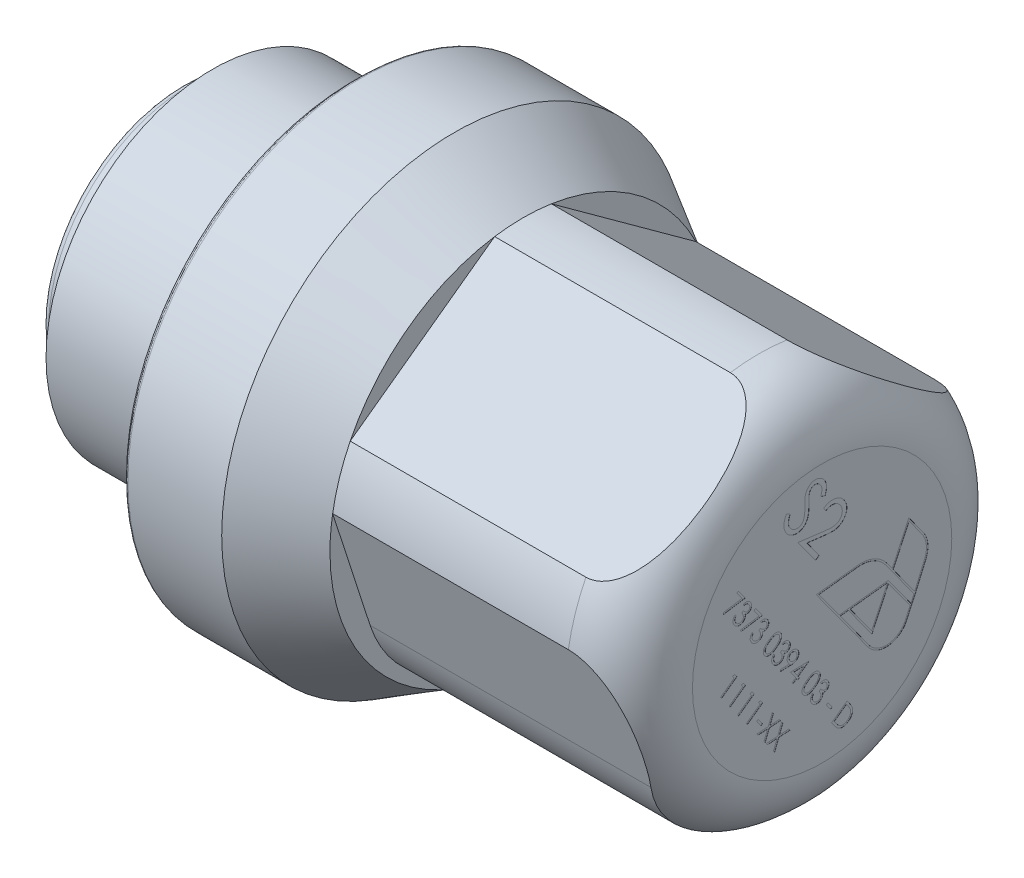
from build123d import *

# Parameters (mm, degrees)
SKETCH2_OUTSIDE_W  = 53.184
SKETCH2_OUTSIDE_H  = 53.184
EXTRUDE1_DEPTH     = 23.587341226
SKETCH3_W          = 0.576923077
SKETCH3_H          = 0.153846153
CUT_EXTRUDE1_DEPTH = 0.01


with BuildPart() as part:
    # Sketch1 → Revolve1 (revolve)
    with BuildSketch(Plane.XY, mode=Mode.PRIVATE) as revolve1_sk:
        with BuildLine():
            Line((0, 8.353553391), (0, 10.5))
            ThreePointArc((0, 10.5), (0.146446609, 10.853553391), (0.5, 11))
            Line((0.5, 11), (1.2, 11))
            Line((1.2, 11), (2.435529576, 13.14))
            Line((2.435529576, 13.14), (10.36, 13.14))
            Line((10.36, 13.14), (11.5, 12))
            Line((11.5, 12), (12.7, 12))
            ThreePointArc((12.7, 12), (13.265685425, 12.234314575), (13.5, 12.8))
            Line((13.5, 12.8), (13.5, 13))
            ThreePointArc((13.5, 13), (13.573223305, 13.176776695), (13.75, 13.25))
            Line((13.75, 13.25), (15.5, 13.25))
            Line((15.5, 13.25), (15.5, 16.45))
            Line((15.5, 16.45), (13.75, 16.45))
            ThreePointArc((13.75, 16.45), (13.573223305, 16.523223305), (13.5, 16.7))
            Line((13.5, 16.7), (13.5, 17.746446609))
            ThreePointArc((13.5, 17.746446609), (13.519030117, 17.842117467), (13.573223305, 17.923223305))
            Line((13.573223305, 17.923223305), (13.926776695, 18.276776695))
            ThreePointArc((13.926776695, 18.276776695), (14.007882533, 18.330969883), (14.103553391, 18.35))
            Line((14.103553391, 18.35), (21.5, 18.35))
            Line((21.5, 18.35), (26.912658774, 15.225))
            Line((26.912658774, 15.225), (45.5, 15.225))
            ThreePointArc((45.5, 15.225), (49.035533906, 13.760533906), (50.5, 10.225))
            Line((50.5, 10.225), (50.5, 0))
            Line((50.5, 0), (7.5, 0))
            Line((7.5, 0), (7.5, 6.25))
            ThreePointArc((7.5, 6.25), (7.060660172, 7.310660172), (6, 7.75))
            Line((6, 7.75), (0.603553391, 7.75))
            ThreePointArc((0.603553391, 7.75), (0.507882533, 7.769030117), (0.426776695, 7.823223305))
            Line((0.426776695, 7.823223305), (0.073223305, 8.176776695))
            ThreePointArc((0.073223305, 8.176776695), (0.019030117, 8.257882533), (0, 8.353553391))
        make_face()
    revolve(revolve1_sk.sketch.rotate(Axis((0, 0, 0), (1, 0, 0)), 90), axis=Axis((0, 0, 0), (1, 0, 0)))

    # Sketch2 outside → Extrude1 (cut)
    with BuildSketch(Plane(origin=(26.912658774, 0, 0), x_dir=(0, 0, -1), z_dir=(1, 0, 0))):
        Rectangle(SKETCH2_OUTSIDE_W, SKETCH2_OUTSIDE_H)
        with BuildLine():
            Line((0, 16.685), (-15.866745713, 5.160969434))
            Line((-15.866745713, 5.160969434), (-12.056198931, -6.585655535))
            ThreePointArc((-12.056198931, -6.585655535), (-8.423940434, -11.588774794), (-2.544168132, -13.5))
            Line((-2.544168132, -13.5), (2.544168132, -13.5))
            ThreePointArc((2.544168132, -13.5), (8.423940434, -11.588774794), (12.056198931, -6.585655535))
            Line((12.056198931, -6.585655535), (15.866745713, 5.160969434))
            Line((15.866745713, 5.160969434), (0, 16.685))
        make_face(mode=Mode.SUBTRACT)
    extrude(amount=EXTRUDE1_DEPTH, mode=Mode.SUBTRACT)

    # Sketch3 → Cut-Extrude1 (cut)
    # profile 1 of 22: a face of its own
    with BuildSketch(Plane(origin=(50.5, -24.640613132, -29.288460637), x_dir=(0, 0.8090169943749485, 0.5877852522924717), z_dir=(-1, 0, 0))):
        Polygon((44.933747801, -11.712092869), (44.010670878, -11.712092869), (44.799132417, -13.250554408), (44.915418474, -13.186552004), (44.238735782, -11.865939023), (44.933747801, -11.865939023), align=None)
    # profile 2 of 22: a face of its own
    with BuildSketch(Plane(origin=(50.5, -24.640613132, -29.288460637), x_dir=(0, 0.8090169943749485, 0.5877852522924717), z_dir=(-1, 0, 0))):
        with BuildLine():
            Line((43.683747801, -12.058246716), (43.818363186, -12.058246716))
            add(Edge.make_bspline(
                [(43.818363186, -12.058246716), (43.814716235, -12.04314708), (43.807586746, -12.013628526), (43.792716357, -11.971453986), (43.776516677, -11.931543905), (43.757064203, -11.894645588), (43.735846166, -11.860017487), (43.711536428, -11.828445005), (43.685256547, -11.799125163), (43.656188711, -11.773105204), (43.625704999, -11.74954332), (43.593375876, -11.729454009), (43.559851779, -11.71217223), (43.524900436, -11.697934987), (43.488417791, -11.687209763), (43.450733667, -11.679428275), (43.41174931, -11.67437494), (43.385286057, -11.673881756), (43.371848763, -11.673631331)],
                knots=[0, 0, 0, 0, 1.162005537, 2.271625781, 3.343758855, 4.383309926, 5.390229558, 6.379919256, 7.361854164, 8.333198761, 9.295911338, 10.242430842, 11.177959212, 12.116337295, 13.062827104, 14.020064771, 14.994644689, 16, 16, 16, 16], degree=3))
            add(Edge.make_bspline(
                [(43.371848763, -11.673631331), (43.352270445, -11.67422243), (43.313540869, -11.675391733), (43.25664242, -11.686069349), (43.201773783, -11.702965834), (43.149535534, -11.726311717), (43.101013349, -11.75510628), (43.057840697, -11.789376882), (43.020602764, -11.828462297), (42.989362316, -11.871633396), (42.964901603, -11.917771471), (42.946864585, -11.965257253), (42.935883865, -12.013978098), (42.934460769, -12.046874074), (42.933747801, -12.063354889)],
                knots=[0, 0, 0, 0, 1.083050992, 2.142477498, 3.193116406, 4.255571735, 5.30263384, 6.308962982, 7.297363603, 8.282367274, 9.249857812, 10.179914175, 11.08814088, 12, 12, 12, 12], degree=3))
            add(Edge.make_bspline(
                [(42.933747801, -12.063354889), (42.934246483, -12.079214943), (42.935222326, -12.11025061), (42.9435082, -12.155559823), (42.957452313, -12.198263366), (42.976767925, -12.238541007), (43.001771447, -12.276137367), (43.032059745, -12.311137034), (43.0678466, -12.343695245), (43.094966145, -12.362346447), (43.10892809, -12.371948639)],
                knots=[0, 0, 0, 0, 1.024540389, 2.004866551, 2.965041327, 3.920577974, 4.882998113, 5.874504559, 6.905732034, 8, 8, 8, 8], degree=3))
            add(Edge.make_bspline(
                [(43.10892809, -12.371948639), (43.092971623, -12.379653569), (43.061357249, -12.394919265), (43.018264165, -12.424857447), (42.979145075, -12.459424453), (42.957329196, -12.486399876), (42.946367993, -12.499953446)],
                knots=[0, 0, 0, 0, 1.015518401, 2.012035669, 3.001164323, 4, 4, 4, 4], degree=3))
            add(Edge.make_bspline(
                [(42.946367993, -12.499953446), (42.939150275, -12.50983534), (42.924833034, -12.529437304), (42.907160663, -12.560952915), (42.891128185, -12.592817839), (42.878635234, -12.625886156), (42.868960719, -12.65977459), (42.862045277, -12.694541332), (42.857749217, -12.73021477), (42.85713398, -12.75434869), (42.856824724, -12.766479889)],
                knots=[0, 0, 0, 0, 1.025084078, 2.033381695, 3.024893161, 4.013698104, 4.991890475, 5.976764909, 6.982997093, 8, 8, 8, 8], degree=3))
            add(Edge.make_bspline(
                [(42.856824724, -12.766479889), (42.857593801, -12.787484055), (42.859128337, -12.829393541), (42.872844368, -12.891311279), (42.894107186, -12.951836494), (42.924303016, -13.009725711), (42.961103377, -13.063888732), (43.004885087, -13.112350007), (43.055150691, -13.154006552), (43.111210254, -13.188810935), (43.171946167, -13.216632902), (43.236907135, -13.235943234), (43.305157158, -13.248520091), (43.351960285, -13.24986875), (43.375755013, -13.250554408)],
                knots=[0, 0, 0, 0, 0.955779014, 1.907060117, 2.875433937, 3.871313158, 4.872415639, 5.851225146, 6.836215519, 7.83643374, 8.849228613, 9.86973379, 10.916971861, 12, 12, 12, 12], degree=3))
            add(Edge.make_bspline(
                [(43.375755013, -13.250554408), (43.391791856, -13.250182316), (43.423347015, -13.249450165), (43.469737086, -13.24444505), (43.514017814, -13.235303619), (43.55624907, -13.223002202), (43.596468372, -13.207405742), (43.634552988, -13.187983442), (43.670737228, -13.165135656), (43.704679636, -13.13859269), (43.736376165, -13.108900687), (43.764984475, -13.07553254), (43.790981529, -13.039105081), (43.813671232, -12.9991952), (43.834087068, -12.956318661), (43.850878907, -12.909926447), (43.865658436, -12.860433295), (43.872529921, -12.825942835), (43.876055493, -12.808246716)],
                knots=[0, 0, 0, 0, 1.048658725, 2.063410685, 3.046034179, 4.001477787, 4.936774919, 5.862367409, 6.792675028, 7.730719943, 8.675894397, 9.627829632, 10.600096036, 11.597688215, 12.626045268, 13.701542398, 14.82072376, 16, 16, 16, 16], degree=3))
            Line((43.876055493, -12.808246716), (43.741440109, -12.808246716))
            add(Edge.make_bspline(
                [(43.741440109, -12.808246716), (43.737932984, -12.819796293), (43.731111321, -12.842261223), (43.719499479, -12.874592783), (43.70627022, -12.904231949), (43.692078266, -12.931396144), (43.677173218, -12.956352888), (43.660495393, -12.97844226), (43.643280045, -12.99863449), (43.630303179, -13.010010752), (43.623952128, -13.015578446)],
                knots=[0, 0, 0, 0, 1.198163088, 2.33053128, 3.407730985, 4.417276592, 5.372219308, 6.28897303, 7.162600585, 8, 8, 8, 8], degree=3))
            add(Edge.make_bspline(
                [(43.623952128, -13.015578446), (43.615553595, -13.022053447), (43.598782454, -13.03498346), (43.571453212, -13.051484158), (43.542711118, -13.06578174), (43.511933401, -13.076703324), (43.479784213, -13.085950893), (43.445743914, -13.092002544), (43.410112821, -13.096154618), (43.385783779, -13.096521017), (43.373351167, -13.096708254)],
                knots=[0, 0, 0, 0, 0.946170439, 1.889420265, 2.845303464, 3.807233317, 4.801018734, 5.828864929, 6.890507805, 8, 8, 8, 8], degree=3))
            add(Edge.make_bspline(
                [(43.373351167, -13.096708254), (43.359313951, -13.096444295), (43.331865388, -13.095928145), (43.291813306, -13.091181413), (43.253710114, -13.084268379), (43.21797886, -13.073591386), (43.1841515, -13.060399593), (43.152702221, -13.043835991), (43.123218176, -13.024402538), (43.096077002, -13.002314328), (43.071671784, -12.978133687), (43.050183422, -12.952842371), (43.03191571, -12.926547015), (43.01717989, -12.899102106), (43.00554394, -12.870621294), (42.997622569, -12.841024653), (42.992114776, -12.810554396), (42.991666228, -12.78984198), (42.991440109, -12.779400562)],
                knots=[0, 0, 0, 0, 1.217147791, 2.380027433, 3.494444702, 4.572153297, 5.609568379, 6.639424714, 7.649109417, 8.668170816, 9.669597737, 10.625200337, 11.543417969, 12.441394052, 13.322311151, 14.205496177, 15.095365482, 16, 16, 16, 16], degree=3))
            add(Edge.make_bspline(
                [(42.991440109, -12.779400562), (42.992095952, -12.765424274), (42.993404376, -12.737541241), (43.003393767, -12.696519424), (43.019824709, -12.656995104), (43.042827214, -12.619642623), (43.07082824, -12.585024379), (43.103556058, -12.554136601), (43.141282441, -12.528649419), (43.176005242, -12.511039995), (43.206761738, -12.499024106), (43.233082617, -12.49102055), (43.262549733, -12.484243269), (43.294806739, -12.477938009), (43.330096689, -12.472571717), (43.368381163, -12.468096653), (43.409667918, -12.464515922), (43.438249846, -12.462916881), (43.45297857, -12.462092869)],
                knots=[0, 0, 0, 0, 1.07054697, 2.135767047, 3.216561865, 4.33974944, 5.486079747, 6.621378074, 7.775625952, 8.963672916, 9.598146892, 10.304877434, 11.070270905, 11.915000392, 12.823868403, 13.805723172, 14.86925407, 16, 16, 16, 16], degree=3))
            Line((43.45297857, -12.462092869), (43.45297857, -12.308246716))
            add(Edge.make_bspline(
                [(43.45297857, -12.308246716), (43.434420928, -12.3079318), (43.398071065, -12.307314957), (43.344973506, -12.299854381), (43.294199229, -12.289534112), (43.246873483, -12.273726172), (43.20373832, -12.255366045), (43.166315633, -12.234000812), (43.135129713, -12.210251634), (43.110332111, -12.183751944), (43.091676727, -12.15533121), (43.078036671, -12.125709785), (43.069979389, -12.094628045), (43.068903817, -12.073416044), (43.068363186, -12.062753927)],
                knots=[0, 0, 0, 0, 1.321986639, 2.589447074, 3.816329219, 5.01088745, 6.139805852, 7.153945165, 8.075214402, 8.924034688, 9.728124013, 10.488707548, 11.240355623, 12, 12, 12, 12], degree=3))
            add(Edge.make_bspline(
                [(43.068363186, -12.062753927), (43.06854079, -12.054920608), (43.068894127, -12.03933659), (43.073350103, -12.016568704), (43.08004612, -11.99449687), (43.089251719, -11.973214951), (43.101573232, -11.952870548), (43.116318655, -11.933290213), (43.133876412, -11.914585736), (43.15399589, -11.897151313), (43.175600949, -11.880535926), (43.199279424, -11.866430082), (43.22431737, -11.854367912), (43.250742508, -11.844420983), (43.278640593, -11.836938431), (43.307880546, -11.831565927), (43.338518124, -11.828206932), (43.359420295, -11.827723325), (43.370045878, -11.827477485)],
                knots=[0, 0, 0, 0, 0.884392785, 1.759457502, 2.611959086, 3.489218968, 4.37281399, 5.2945488, 6.255912374, 7.266815255, 8.301784654, 9.332968512, 10.37626691, 11.440494194, 12.520033166, 13.637162961, 14.798855837, 16, 16, 16, 16], degree=3))
            add(Edge.make_bspline(
                [(43.370045878, -11.827477485), (43.387125164, -11.828073783), (43.420484983, -11.829238491), (43.46857709, -11.839439783), (43.513285376, -11.855716104), (43.54745909, -11.875144541), (43.572694479, -11.894323299), (43.590727453, -11.911072893), (43.608436243, -11.92968696), (43.624655819, -11.951311978), (43.641058952, -11.97448346), (43.655992335, -12.000379323), (43.670503632, -12.028324064), (43.679247582, -12.048079336), (43.683747801, -12.058246716)],
                knots=[0, 0, 0, 0, 1.472543308, 2.876219568, 4.221790263, 5.565193594, 6.249813518, 6.953379497, 7.687249741, 8.463570142, 9.283606569, 10.136032583, 11.040678096, 12, 12, 12, 12], degree=3))
        make_face()
    # profile 3 of 22: a face of its own
    with BuildSketch(Plane(origin=(50.5, -24.640613132, -29.288460637), x_dir=(0, 0.8090169943749485, 0.5877852522924717), z_dir=(-1, 0, 0))):
        Polygon((42.626055493, -11.712092869), (41.70297857, -11.712092869), (42.491440109, -13.250554408), (42.607726167, -13.186552004), (41.931043474, -11.865939023), (42.626055493, -11.865939023), align=None)
    # profile 4 of 22: a face of its own
    with BuildSketch(Plane(origin=(50.5, -24.640613132, -29.288460637), x_dir=(0, 0.8090169943749485, 0.5877852522924717), z_dir=(-1, 0, 0))):
        with BuildLine():
            Line((41.376055493, -12.058246716), (41.510670878, -12.058246716))
            add(Edge.make_bspline(
                [(41.510670878, -12.058246716), (41.507023928, -12.04314708), (41.499894438, -12.013628526), (41.48502405, -11.971453986), (41.468824369, -11.931543905), (41.449371895, -11.894645588), (41.428153858, -11.860017487), (41.40384412, -11.828445005), (41.377564239, -11.799125163), (41.348496404, -11.773105204), (41.318012691, -11.74954332), (41.285683569, -11.729454009), (41.252159471, -11.71217223), (41.217208129, -11.697934987), (41.180725484, -11.687209763), (41.143041359, -11.679428275), (41.104057002, -11.67437494), (41.077593749, -11.673881756), (41.064156455, -11.673631331)],
                knots=[0, 0, 0, 0, 1.162005537, 2.271625781, 3.343758855, 4.383309926, 5.390229558, 6.379919256, 7.361854164, 8.333198761, 9.295911338, 10.242430842, 11.177959212, 12.116337295, 13.062827104, 14.020064771, 14.994644689, 16, 16, 16, 16], degree=3))
            add(Edge.make_bspline(
                [(41.064156455, -11.673631331), (41.044578137, -11.67422243), (41.005848561, -11.675391733), (40.948950112, -11.686069349), (40.894081475, -11.702965834), (40.841843226, -11.726311717), (40.793321041, -11.75510628), (40.750148389, -11.789376882), (40.712910456, -11.828462297), (40.681670009, -11.871633396), (40.657209295, -11.917771471), (40.639172278, -11.965257253), (40.628191557, -12.013978098), (40.626768461, -12.046874074), (40.626055493, -12.063354889)],
                knots=[0, 0, 0, 0, 1.083050992, 2.142477498, 3.193116406, 4.255571735, 5.30263384, 6.308962982, 7.297363603, 8.282367274, 9.249857812, 10.179914175, 11.08814088, 12, 12, 12, 12], degree=3))
            add(Edge.make_bspline(
                [(40.626055493, -12.063354889), (40.626554175, -12.079214943), (40.627530018, -12.11025061), (40.635815892, -12.155559823), (40.649760005, -12.198263366), (40.669075617, -12.238541007), (40.694079139, -12.276137367), (40.724367438, -12.311137034), (40.760154293, -12.343695245), (40.787273838, -12.362346447), (40.801235782, -12.371948639)],
                knots=[0, 0, 0, 0, 1.024540389, 2.004866551, 2.965041327, 3.920577974, 4.882998113, 5.874504559, 6.905732034, 8, 8, 8, 8], degree=3))
            add(Edge.make_bspline(
                [(40.801235782, -12.371948639), (40.785279316, -12.379653569), (40.753664941, -12.394919265), (40.710571857, -12.424857447), (40.671452767, -12.459424453), (40.649636888, -12.486399876), (40.638675686, -12.499953446)],
                knots=[0, 0, 0, 0, 1.015518401, 2.012035669, 3.001164323, 4, 4, 4, 4], degree=3))
            add(Edge.make_bspline(
                [(40.638675686, -12.499953446), (40.631457968, -12.50983534), (40.617140726, -12.529437304), (40.599468355, -12.560952915), (40.583435877, -12.592817839), (40.570942926, -12.625886156), (40.561268412, -12.65977459), (40.554352969, -12.694541332), (40.550056909, -12.73021477), (40.549441672, -12.75434869), (40.549132417, -12.766479889)],
                knots=[0, 0, 0, 0, 1.025084078, 2.033381695, 3.024893161, 4.013698104, 4.991890475, 5.976764909, 6.982997093, 8, 8, 8, 8], degree=3))
            add(Edge.make_bspline(
                [(40.549132417, -12.766479889), (40.549901494, -12.787484055), (40.551436029, -12.829393541), (40.565152061, -12.891311279), (40.586414878, -12.951836494), (40.616610708, -13.009725711), (40.653411069, -13.063888732), (40.697192779, -13.112350007), (40.747458383, -13.154006552), (40.803517947, -13.188810935), (40.864253859, -13.216632902), (40.929214827, -13.235943234), (40.99746485, -13.248520091), (41.044267977, -13.24986875), (41.068062705, -13.250554408)],
                knots=[0, 0, 0, 0, 0.955779014, 1.907060117, 2.875433937, 3.871313158, 4.872415639, 5.851225146, 6.836215519, 7.83643374, 8.849228613, 9.86973379, 10.916971861, 12, 12, 12, 12], degree=3))
            add(Edge.make_bspline(
                [(41.068062705, -13.250554408), (41.084099548, -13.250182316), (41.115654707, -13.249450165), (41.162044778, -13.24444505), (41.206325506, -13.235303619), (41.248556763, -13.223002202), (41.288776064, -13.207405742), (41.32686068, -13.187983442), (41.36304492, -13.165135656), (41.396987328, -13.13859269), (41.428683857, -13.108900687), (41.457292168, -13.07553254), (41.483289222, -13.039105081), (41.505978924, -12.9991952), (41.526394761, -12.956318661), (41.543186599, -12.909926447), (41.557966129, -12.860433295), (41.564837613, -12.825942835), (41.568363186, -12.808246716)],
                knots=[0, 0, 0, 0, 1.048658725, 2.063410685, 3.046034179, 4.001477787, 4.936774919, 5.862367409, 6.792675028, 7.730719943, 8.675894397, 9.627829632, 10.600096036, 11.597688215, 12.626045268, 13.701542398, 14.82072376, 16, 16, 16, 16], degree=3))
            Line((41.568363186, -12.808246716), (41.433747801, -12.808246716))
            add(Edge.make_bspline(
                [(41.433747801, -12.808246716), (41.430240676, -12.819796293), (41.423419014, -12.842261223), (41.411807172, -12.874592783), (41.398577912, -12.904231949), (41.384385959, -12.931396144), (41.36948091, -12.956352888), (41.352803085, -12.97844226), (41.335587737, -12.99863449), (41.322610872, -13.010010752), (41.31625982, -13.015578446)],
                knots=[0, 0, 0, 0, 1.198163088, 2.33053128, 3.407730985, 4.417276592, 5.372219308, 6.28897303, 7.162600585, 8, 8, 8, 8], degree=3))
            add(Edge.make_bspline(
                [(41.31625982, -13.015578446), (41.307861288, -13.022053447), (41.291090146, -13.03498346), (41.263760904, -13.051484158), (41.23501881, -13.06578174), (41.204241093, -13.076703324), (41.172091906, -13.085950893), (41.138051606, -13.092002544), (41.102420513, -13.096154618), (41.078091472, -13.096521017), (41.065658859, -13.096708254)],
                knots=[0, 0, 0, 0, 0.946170439, 1.889420265, 2.845303464, 3.807233317, 4.801018734, 5.828864929, 6.890507805, 8, 8, 8, 8], degree=3))
            add(Edge.make_bspline(
                [(41.065658859, -13.096708254), (41.051621643, -13.096444295), (41.02417308, -13.095928145), (40.984120998, -13.091181413), (40.946017806, -13.084268379), (40.910286552, -13.073591386), (40.876459192, -13.060399593), (40.845009913, -13.043835991), (40.815525868, -13.024402538), (40.788384694, -13.002314328), (40.763979477, -12.978133687), (40.742491114, -12.952842371), (40.724223402, -12.926547015), (40.709487583, -12.899102106), (40.697851632, -12.870621294), (40.689930261, -12.841024653), (40.684422469, -12.810554396), (40.683973921, -12.78984198), (40.683747801, -12.779400562)],
                knots=[0, 0, 0, 0, 1.217147791, 2.380027433, 3.494444702, 4.572153297, 5.609568379, 6.639424714, 7.649109417, 8.668170816, 9.669597737, 10.625200337, 11.543417969, 12.441394052, 13.322311151, 14.205496177, 15.095365482, 16, 16, 16, 16], degree=3))
            add(Edge.make_bspline(
                [(40.683747801, -12.779400562), (40.684403645, -12.765424274), (40.685712068, -12.737541241), (40.69570146, -12.696519424), (40.712132401, -12.656995104), (40.735134906, -12.619642623), (40.763135933, -12.585024379), (40.79586375, -12.554136601), (40.833590134, -12.528649419), (40.868312935, -12.511039995), (40.89906943, -12.499024106), (40.925390309, -12.49102055), (40.954857425, -12.484243269), (40.987114432, -12.477938009), (41.022404382, -12.472571717), (41.060688855, -12.468096653), (41.10197561, -12.464515922), (41.130557538, -12.462916881), (41.145286263, -12.462092869)],
                knots=[0, 0, 0, 0, 1.07054697, 2.135767047, 3.216561865, 4.33974944, 5.486079747, 6.621378074, 7.775625952, 8.963672916, 9.598146892, 10.304877434, 11.070270905, 11.915000392, 12.823868403, 13.805723172, 14.86925407, 16, 16, 16, 16], degree=3))
            Line((41.145286263, -12.462092869), (41.145286263, -12.308246716))
            add(Edge.make_bspline(
                [(41.145286263, -12.308246716), (41.12672862, -12.3079318), (41.090378757, -12.307314957), (41.037281198, -12.299854381), (40.986506922, -12.289534112), (40.939181175, -12.273726172), (40.896046012, -12.255366045), (40.858623326, -12.234000812), (40.827437405, -12.210251634), (40.802639803, -12.183751944), (40.78398442, -12.15533121), (40.770344364, -12.125709785), (40.762287081, -12.094628045), (40.761211509, -12.073416044), (40.760670878, -12.062753927)],
                knots=[0, 0, 0, 0, 1.321986639, 2.589447074, 3.816329219, 5.01088745, 6.139805852, 7.153945165, 8.075214402, 8.924034688, 9.728124013, 10.488707548, 11.240355623, 12, 12, 12, 12], degree=3))
            add(Edge.make_bspline(
                [(40.760670878, -12.062753927), (40.760848483, -12.054920608), (40.761201819, -12.03933659), (40.765657795, -12.016568704), (40.772353813, -11.99449687), (40.781559411, -11.973214951), (40.793880925, -11.952870548), (40.808626347, -11.933290213), (40.826184105, -11.914585736), (40.846303582, -11.897151313), (40.867908641, -11.880535926), (40.891587116, -11.866430082), (40.916625063, -11.854367912), (40.9430502, -11.844420983), (40.970948285, -11.836938431), (41.000188238, -11.831565927), (41.030825817, -11.828206932), (41.051727988, -11.827723325), (41.06235357, -11.827477485)],
                knots=[0, 0, 0, 0, 0.884392785, 1.759457502, 2.611959086, 3.489218968, 4.37281399, 5.2945488, 6.255912374, 7.266815255, 8.301784654, 9.332968512, 10.37626691, 11.440494194, 12.520033166, 13.637162961, 14.798855837, 16, 16, 16, 16], degree=3))
            add(Edge.make_bspline(
                [(41.06235357, -11.827477485), (41.079432857, -11.828073783), (41.112792675, -11.829238491), (41.160884782, -11.839439783), (41.205593068, -11.855716104), (41.239766783, -11.875144541), (41.265002172, -11.894323299), (41.283035145, -11.911072893), (41.300743935, -11.92968696), (41.316963511, -11.951311978), (41.333366644, -11.97448346), (41.348300027, -12.000379323), (41.362811324, -12.028324064), (41.371555274, -12.048079336), (41.376055493, -12.058246716)],
                knots=[0, 0, 0, 0, 1.472543308, 2.876219568, 4.221790263, 5.565193594, 6.249813518, 6.953379497, 7.687249741, 8.463570142, 9.283606569, 10.136032583, 11.040678096, 12, 12, 12, 12], degree=3))
        make_face()
    # profile 5 of 22: a face of its own
    with BuildSketch(Plane(origin=(50.5, -24.640613132, -29.288460637), x_dir=(0, 0.8090169943749485, 0.5877852522924717), z_dir=(-1, 0, 0))):
        with BuildLine():
            add(Edge.make_bspline(
                [(39.837593955, -12.462693831), (39.837453376, -12.438652093), (39.837180299, -12.391950671), (39.834142404, -12.323900111), (39.829095829, -12.260059987), (39.822179812, -12.200427244), (39.813763535, -12.144986488), (39.802528326, -12.093885878), (39.789751411, -12.046888903), (39.77494322, -12.003842311), (39.758234167, -11.964166153), (39.740048055, -11.927126781), (39.719663143, -11.892780238), (39.698244466, -11.860578328), (39.674925007, -11.831048173), (39.650368383, -11.803772747), (39.62361615, -11.779382425), (39.595577718, -11.757162581), (39.565999233, -11.737684236), (39.535723805, -11.720527348), (39.504543045, -11.705870262), (39.472371824, -11.69434579), (39.439499299, -11.684826855), (39.405810556, -11.678317306), (39.371249972, -11.674221488), (39.347922214, -11.673829916), (39.336091551, -11.673631331)],
                knots=[0, 0, 0, 0, 1.646270934, 3.197905019, 4.663502075, 6.030701355, 7.308322542, 8.50163776, 9.611534131, 10.641858119, 11.616356847, 12.558055219, 13.465016945, 14.349605745, 15.204443733, 16.039544428, 16.859896111, 17.680448484, 18.487036065, 19.28249412, 20.06191084, 20.843045899, 21.620316918, 22.403196591, 23.190181807, 24, 24, 24, 24], degree=3))
            add(Edge.make_bspline(
                [(39.336091551, -11.673631331), (39.32416206, -11.673840395), (39.300438057, -11.674256156), (39.26536361, -11.678252132), (39.231099461, -11.684882613), (39.197791687, -11.694277316), (39.165166693, -11.705932606), (39.133479661, -11.720541371), (39.102533769, -11.7375466), (39.072820788, -11.757528262), (39.044014525, -11.77980638), (39.016822541, -11.804990381), (38.991242361, -11.832825975), (38.966952944, -11.863015345), (38.944643403, -11.896137524), (38.923397646, -11.931616428), (38.904381059, -11.970072513), (38.886066198, -12.010864142), (38.87025749, -12.055119996), (38.856000528, -12.102590608), (38.84448097, -12.153836688), (38.834885567, -12.208589364), (38.82745204, -12.267049714), (38.822038051, -12.329092421), (38.819178157, -12.394758303), (38.818639571, -12.439654524), (38.818363186, -12.462693831)],
                knots=[0, 0, 0, 0, 0.810914788, 1.612654377, 2.396697861, 3.181598691, 3.963628158, 4.749916497, 5.551656086, 6.361998678, 7.18212741, 8.025565596, 8.878627764, 9.750805457, 10.657531673, 11.591944965, 12.560506719, 13.57287815, 14.630710178, 15.753379473, 16.941251878, 18.199788006, 19.531962791, 20.947069417, 22.433333509, 24, 24, 24, 24], degree=3))
            add(Edge.make_bspline(
                [(38.818363186, -12.462693831), (38.818642436, -12.485632649), (38.819186545, -12.530327999), (38.82200599, -12.595698417), (38.827559689, -12.657411865), (38.834506827, -12.715616348), (38.844128669, -12.770069614), (38.855959454, -12.820960092), (38.869095307, -12.868507551), (38.885310218, -12.91232247), (38.903057666, -12.953016066), (38.922367036, -12.991016272), (38.943054104, -13.026658969), (38.965592137, -13.05965886), (38.989615029, -13.090249713), (39.015636938, -13.117891552), (39.042924332, -13.143250411), (39.071815367, -13.165815394), (39.101991746, -13.185566025), (39.132831351, -13.203229104), (39.164881372, -13.217471687), (39.197415495, -13.229700991), (39.23089908, -13.239044041), (39.265290391, -13.245504265), (39.300414492, -13.250035057), (39.32415802, -13.250380692), (39.336091551, -13.250554408)],
                knots=[0, 0, 0, 0, 1.561518951, 3.042555995, 4.452378317, 5.7783523, 7.031515105, 8.214008947, 9.334062868, 10.386615937, 11.391082383, 12.354592575, 13.286541444, 14.194233754, 15.072674879, 15.931287219, 16.775624067, 17.606195743, 18.42308326, 19.229000347, 20.022332153, 20.807536673, 21.593273796, 22.3848459, 23.188221202, 24, 24, 24, 24], degree=3))
            add(Edge.make_bspline(
                [(39.336091551, -13.250554408), (39.347921886, -13.250354541), (39.371248996, -13.249960443), (39.405814322, -13.24588313), (39.43936394, -13.239327914), (39.472063406, -13.230149369), (39.504080484, -13.21891444), (39.534978893, -13.204277147), (39.565102186, -13.187419689), (39.594369995, -13.168221651), (39.62223235, -13.146226644), (39.648846038, -13.121899091), (39.673542475, -13.094631915), (39.696528516, -13.064855662), (39.718374554, -13.032844273), (39.738469999, -12.998160684), (39.757057508, -12.960942423), (39.774047576, -12.920949032), (39.789111289, -12.877596921), (39.802417449, -12.83039013), (39.812923517, -12.778912), (39.821916212, -12.723575985), (39.829169519, -12.664144301), (39.834121373, -12.600584682), (39.837181936, -12.532936735), (39.837454109, -12.486535403), (39.837593955, -12.462693831)],
                knots=[0, 0, 0, 0, 0.810891512, 1.598919785, 2.382837074, 3.152667961, 3.926044502, 4.706494248, 5.493654104, 6.291793342, 7.103789334, 7.925228297, 8.761435821, 9.622817696, 10.50288917, 11.416980706, 12.369136599, 13.353924996, 14.394355917, 15.514179734, 16.714354668, 17.994756427, 19.357759367, 20.818452758, 22.365282078, 24, 24, 24, 24], degree=3))
        make_face()
        with BuildLine():
            add(Edge.make_bspline(
                [(39.70297857, -12.462092869), (39.702927379, -12.482128026), (39.702828026, -12.521012331), (39.700232511, -12.577516586), (39.696696698, -12.630218155), (39.692136142, -12.679183956), (39.68536345, -12.724248248), (39.677774826, -12.765720969), (39.668539931, -12.803382642), (39.657613494, -12.837491704), (39.645168167, -12.868627019), (39.63157994, -12.897598968), (39.616982487, -12.924749798), (39.600645708, -12.94983563), (39.582853538, -12.972938272), (39.564007856, -12.994466629), (39.54340532, -13.013665335), (39.514903716, -13.03669113), (39.477276655, -13.060485044), (39.429867889, -13.081204797), (39.381152838, -13.09422585), (39.348088017, -13.095881745), (39.33158434, -13.096708254)],
                knots=[0, 0, 0, 0, 1.459021318, 2.831673884, 4.118529203, 5.306027144, 6.411944654, 7.436330062, 8.375795394, 9.233974572, 10.042671642, 10.816086306, 11.563610507, 12.285937304, 12.993564865, 13.685989202, 14.367179055, 15.041617293, 16.353048772, 17.594441528, 18.799311195, 20, 20, 20, 20], degree=3))
            add(Edge.make_bspline(
                [(39.33158434, -13.096708254), (39.314973909, -13.096023491), (39.281787342, -13.094655378), (39.23330143, -13.081455919), (39.186231314, -13.061540402), (39.149343339, -13.037991471), (39.121279392, -13.015565045), (39.101172111, -12.996444481), (39.082716947, -12.975034824), (39.065213201, -12.951935125), (39.049159311, -12.926704061), (39.034560824, -12.899462957), (39.021239389, -12.870136166), (39.013649798, -12.849663421), (39.009769436, -12.839196235)],
                knots=[0, 0, 0, 0, 1.353760809, 2.704726607, 4.075137775, 5.516104923, 6.260822281, 7.007110065, 7.778089737, 8.566572457, 9.372053459, 10.217411131, 11.088608312, 12, 12, 12, 12], degree=3))
            add(Edge.make_bspline(
                [(39.009769436, -12.839196235), (39.00524725, -12.825812061), (38.996065272, -12.798636447), (38.984231655, -12.756480597), (38.974912198, -12.712250841), (38.966527898, -12.666211505), (38.96080516, -12.618023062), (38.956198954, -12.567834611), (38.953485803, -12.515608313), (38.953149481, -12.480124746), (38.95297857, -12.462092869)],
                knots=[0, 0, 0, 0, 0.884706709, 1.796334032, 2.740027952, 3.714592787, 4.726048262, 5.777819803, 6.87074269, 8, 8, 8, 8], degree=3))
            add(Edge.make_bspline(
                [(38.95297857, -12.462092869), (38.953214366, -12.44406391), (38.953675632, -12.408795411), (38.95543877, -12.357144762), (38.95999173, -12.30808715), (38.965048495, -12.261411233), (38.972504447, -12.217375389), (38.980543507, -12.175610972), (38.991344027, -12.13663539), (39.002881073, -12.099838427), (39.016085528, -12.065638146), (39.030620843, -12.033875095), (39.046144454, -12.004395927), (39.063005414, -11.977281524), (39.081003564, -11.952410434), (39.100613942, -11.930281322), (39.121058674, -11.910208336), (39.14969461, -11.887295806), (39.187183592, -11.863933651), (39.233831726, -11.842434039), (39.282376288, -11.830087628), (39.315193483, -11.828346905), (39.33158434, -11.827477485)],
                knots=[0, 0, 0, 0, 1.31362396, 2.569729283, 3.763502607, 4.902122613, 5.988968491, 7.01645872, 7.998833611, 8.933434873, 9.825090667, 10.667526885, 11.477055099, 12.250526234, 12.991942729, 13.710640831, 14.402115721, 15.076753259, 16.378508321, 17.609869233, 18.806226677, 20, 20, 20, 20], degree=3))
            add(Edge.make_bspline(
                [(39.33158434, -11.827477485), (39.348174593, -11.828348105), (39.381385324, -11.830090931), (39.430434448, -11.842388039), (39.477450599, -11.863822168), (39.514840445, -11.887373185), (39.543496353, -11.909803889), (39.56367465, -11.929255227), (39.582594439, -11.950532193), (39.600023453, -11.973847299), (39.616347431, -11.998903885), (39.631339294, -12.02589907), (39.644846721, -12.054969655), (39.657311522, -12.086090984), (39.668271288, -12.120197103), (39.677311558, -12.157812386), (39.685663153, -12.199153197), (39.691575411, -12.244461558), (39.696831306, -12.293439623), (39.700209027, -12.34627276), (39.702836708, -12.40287178), (39.702930336, -12.441957134), (39.70297857, -12.462092869)],
                knots=[0, 0, 0, 0, 1.207732386, 2.417664972, 3.655092373, 4.956220595, 5.625982001, 6.301752483, 6.994047911, 7.697131622, 8.419323945, 9.170223765, 9.943494443, 10.752040957, 11.610060368, 12.549350801, 13.567764191, 14.679664412, 15.874934091, 17.154273443, 18.533957287, 20, 20, 20, 20], degree=3))
        make_face(mode=Mode.SUBTRACT)
    # profile 6 of 22: a face of its own
    with BuildSketch(Plane(origin=(50.5, -24.640613132, -29.288460637), x_dir=(0, 0.8090169943749485, 0.5877852522924717), z_dir=(-1, 0, 0))):
        with BuildLine():
            Line((38.491440109, -12.058246716), (38.626055493, -12.058246716))
            add(Edge.make_bspline(
                [(38.626055493, -12.058246716), (38.622408543, -12.04314708), (38.615279054, -12.013628526), (38.600408665, -11.971453986), (38.584208984, -11.931543905), (38.564756511, -11.894645588), (38.543538473, -11.860017487), (38.519228736, -11.828445005), (38.492948854, -11.799125163), (38.463881019, -11.773105204), (38.433397307, -11.74954332), (38.401068184, -11.729454009), (38.367544087, -11.71217223), (38.332592744, -11.697934987), (38.296110099, -11.687209763), (38.258425975, -11.679428275), (38.219441618, -11.67437494), (38.192978365, -11.673881756), (38.17954107, -11.673631331)],
                knots=[0, 0, 0, 0, 1.162005537, 2.271625781, 3.343758855, 4.383309926, 5.390229558, 6.379919256, 7.361854164, 8.333198761, 9.295911338, 10.242430842, 11.177959212, 12.116337295, 13.062827104, 14.020064771, 14.994644689, 16, 16, 16, 16], degree=3))
            add(Edge.make_bspline(
                [(38.17954107, -11.673631331), (38.159962752, -11.67422243), (38.121233176, -11.675391733), (38.064334728, -11.686069349), (38.009466091, -11.702965834), (37.957227842, -11.726311717), (37.908705656, -11.75510628), (37.865533005, -11.789376882), (37.828295072, -11.828462297), (37.797054624, -11.871633396), (37.77259391, -11.917771471), (37.754556893, -11.965257253), (37.743576173, -12.013978098), (37.742153077, -12.046874074), (37.741440109, -12.063354889)],
                knots=[0, 0, 0, 0, 1.083050992, 2.142477498, 3.193116406, 4.255571735, 5.30263384, 6.308962982, 7.297363603, 8.282367274, 9.249857812, 10.179914175, 11.08814088, 12, 12, 12, 12], degree=3))
            add(Edge.make_bspline(
                [(37.741440109, -12.063354889), (37.741938791, -12.079214943), (37.742914634, -12.11025061), (37.751200508, -12.155559823), (37.76514462, -12.198263366), (37.784460233, -12.238541007), (37.809463754, -12.276137367), (37.839752053, -12.311137034), (37.875538908, -12.343695245), (37.902658453, -12.362346447), (37.916620397, -12.371948639)],
                knots=[0, 0, 0, 0, 1.024540389, 2.004866551, 2.965041327, 3.920577974, 4.882998113, 5.874504559, 6.905732034, 8, 8, 8, 8], degree=3))
            add(Edge.make_bspline(
                [(37.916620397, -12.371948639), (37.900663931, -12.379653569), (37.869049556, -12.394919265), (37.825956472, -12.424857447), (37.786837383, -12.459424453), (37.765021503, -12.486399876), (37.754060301, -12.499953446)],
                knots=[0, 0, 0, 0, 1.015518401, 2.012035669, 3.001164323, 4, 4, 4, 4], degree=3))
            add(Edge.make_bspline(
                [(37.754060301, -12.499953446), (37.746842583, -12.50983534), (37.732525342, -12.529437304), (37.71485297, -12.560952915), (37.698820493, -12.592817839), (37.686327542, -12.625886156), (37.676653027, -12.65977459), (37.669737585, -12.694541332), (37.665441524, -12.73021477), (37.664826288, -12.75434869), (37.664517032, -12.766479889)],
                knots=[0, 0, 0, 0, 1.025084078, 2.033381695, 3.024893161, 4.013698104, 4.991890475, 5.976764909, 6.982997093, 8, 8, 8, 8], degree=3))
            add(Edge.make_bspline(
                [(37.664517032, -12.766479889), (37.665286109, -12.787484055), (37.666820644, -12.829393541), (37.680536676, -12.891311279), (37.701799494, -12.951836494), (37.731995323, -13.009725711), (37.768795684, -13.063888732), (37.812577395, -13.112350007), (37.862842998, -13.154006552), (37.918902562, -13.188810935), (37.979638474, -13.216632902), (38.044599442, -13.235943234), (38.112849465, -13.248520091), (38.159652593, -13.24986875), (38.18344732, -13.250554408)],
                knots=[0, 0, 0, 0, 0.955779014, 1.907060117, 2.875433937, 3.871313158, 4.872415639, 5.851225146, 6.836215519, 7.83643374, 8.849228613, 9.86973379, 10.916971861, 12, 12, 12, 12], degree=3))
            add(Edge.make_bspline(
                [(38.18344732, -13.250554408), (38.199484163, -13.250182316), (38.231039323, -13.249450165), (38.277429393, -13.24444505), (38.321710122, -13.235303619), (38.363941378, -13.223002202), (38.404160679, -13.207405742), (38.442245296, -13.187983442), (38.478429536, -13.165135656), (38.512371943, -13.13859269), (38.544068473, -13.108900687), (38.572676783, -13.07553254), (38.598673837, -13.039105081), (38.621363539, -12.9991952), (38.641779376, -12.956318661), (38.658571215, -12.909926447), (38.673350744, -12.860433295), (38.680222229, -12.825942835), (38.683747801, -12.808246716)],
                knots=[0, 0, 0, 0, 1.048658725, 2.063410685, 3.046034179, 4.001477787, 4.936774919, 5.862367409, 6.792675028, 7.730719943, 8.675894397, 9.627829632, 10.600096036, 11.597688215, 12.626045268, 13.701542398, 14.82072376, 16, 16, 16, 16], degree=3))
            Line((38.683747801, -12.808246716), (38.549132417, -12.808246716))
            add(Edge.make_bspline(
                [(38.549132417, -12.808246716), (38.545625292, -12.819796293), (38.538803629, -12.842261223), (38.527191787, -12.874592783), (38.513962528, -12.904231949), (38.499770574, -12.931396144), (38.484865526, -12.956352888), (38.468187701, -12.97844226), (38.450972353, -12.99863449), (38.437995487, -13.010010752), (38.431644436, -13.015578446)],
                knots=[0, 0, 0, 0, 1.198163088, 2.33053128, 3.407730985, 4.417276592, 5.372219308, 6.28897303, 7.162600585, 8, 8, 8, 8], degree=3))
            add(Edge.make_bspline(
                [(38.431644436, -13.015578446), (38.423245903, -13.022053447), (38.406474762, -13.03498346), (38.37914552, -13.051484158), (38.350403426, -13.06578174), (38.319625708, -13.076703324), (38.287476521, -13.085950893), (38.253436222, -13.092002544), (38.217805129, -13.096154618), (38.193476087, -13.096521017), (38.181043474, -13.096708254)],
                knots=[0, 0, 0, 0, 0.946170439, 1.889420265, 2.845303464, 3.807233317, 4.801018734, 5.828864929, 6.890507805, 8, 8, 8, 8], degree=3))
            add(Edge.make_bspline(
                [(38.181043474, -13.096708254), (38.167006259, -13.096444295), (38.139557696, -13.095928145), (38.099505613, -13.091181413), (38.061402421, -13.084268379), (38.025671168, -13.073591386), (37.991843807, -13.060399593), (37.960394529, -13.043835991), (37.930910483, -13.024402538), (37.90376931, -13.002314328), (37.879364092, -12.978133687), (37.857875729, -12.952842371), (37.839608017, -12.926547015), (37.824872198, -12.899102106), (37.813236248, -12.870621294), (37.805314876, -12.841024653), (37.799807084, -12.810554396), (37.799358536, -12.78984198), (37.799132417, -12.779400562)],
                knots=[0, 0, 0, 0, 1.217147791, 2.380027433, 3.494444702, 4.572153297, 5.609568379, 6.639424714, 7.649109417, 8.668170816, 9.669597737, 10.625200337, 11.543417969, 12.441394052, 13.322311151, 14.205496177, 15.095365482, 16, 16, 16, 16], degree=3))
            add(Edge.make_bspline(
                [(37.799132417, -12.779400562), (37.79978826, -12.765424274), (37.801096684, -12.737541241), (37.811086075, -12.696519424), (37.827517017, -12.656995104), (37.850519522, -12.619642623), (37.878520548, -12.585024379), (37.911248365, -12.554136601), (37.948974749, -12.528649419), (37.98369755, -12.511039995), (38.014454046, -12.499024106), (38.040774925, -12.49102055), (38.07024204, -12.484243269), (38.102499047, -12.477938009), (38.137788997, -12.472571717), (38.17607347, -12.468096653), (38.217360225, -12.464515922), (38.245942154, -12.462916881), (38.260670878, -12.462092869)],
                knots=[0, 0, 0, 0, 1.07054697, 2.135767047, 3.216561865, 4.33974944, 5.486079747, 6.621378074, 7.775625952, 8.963672916, 9.598146892, 10.304877434, 11.070270905, 11.915000392, 12.823868403, 13.805723172, 14.86925407, 16, 16, 16, 16], degree=3))
            Line((38.260670878, -12.462092869), (38.260670878, -12.308246716))
            add(Edge.make_bspline(
                [(38.260670878, -12.308246716), (38.242113236, -12.3079318), (38.205763373, -12.307314957), (38.152665814, -12.299854381), (38.101891537, -12.289534112), (38.05456579, -12.273726172), (38.011430628, -12.255366045), (37.974007941, -12.234000812), (37.942822021, -12.210251634), (37.918024419, -12.183751944), (37.899369035, -12.15533121), (37.885728979, -12.125709785), (37.877671696, -12.094628045), (37.876596125, -12.073416044), (37.876055493, -12.062753927)],
                knots=[0, 0, 0, 0, 1.321986639, 2.589447074, 3.816329219, 5.01088745, 6.139805852, 7.153945165, 8.075214402, 8.924034688, 9.728124013, 10.488707548, 11.240355623, 12, 12, 12, 12], degree=3))
            add(Edge.make_bspline(
                [(37.876055493, -12.062753927), (37.876233098, -12.054920608), (37.876586434, -12.03933659), (37.88104241, -12.016568704), (37.887738428, -11.99449687), (37.896944026, -11.973214951), (37.90926554, -11.952870548), (37.924010963, -11.933290213), (37.94156872, -11.914585736), (37.961688197, -11.897151313), (37.983293257, -11.880535926), (38.006971732, -11.866430082), (38.032009678, -11.854367912), (38.058434816, -11.844420983), (38.0863329, -11.836938431), (38.115572854, -11.831565927), (38.146210432, -11.828206932), (38.167112603, -11.827723325), (38.177738186, -11.827477485)],
                knots=[0, 0, 0, 0, 0.884392785, 1.759457502, 2.611959086, 3.489218968, 4.37281399, 5.2945488, 6.255912374, 7.266815255, 8.301784654, 9.332968512, 10.37626691, 11.440494194, 12.520033166, 13.637162961, 14.798855837, 16, 16, 16, 16], degree=3))
            add(Edge.make_bspline(
                [(38.177738186, -11.827477485), (38.194817472, -11.828073783), (38.228177291, -11.829238491), (38.276269398, -11.839439783), (38.320977684, -11.855716104), (38.355151398, -11.875144541), (38.380386787, -11.894323299), (38.39841976, -11.911072893), (38.416128551, -11.92968696), (38.432348126, -11.951311978), (38.448751259, -11.97448346), (38.463684643, -12.000379323), (38.478195939, -12.028324064), (38.486939889, -12.048079336), (38.491440109, -12.058246716)],
                knots=[0, 0, 0, 0, 1.472543308, 2.876219568, 4.221790263, 5.565193594, 6.249813518, 6.953379497, 7.687249741, 8.463570142, 9.283606569, 10.136032583, 11.040678096, 12, 12, 12, 12], degree=3))
        make_face()
    # profile 7 of 22: a face of its own
    with BuildSketch(Plane(origin=(50.5, -24.640613132, -29.288460637), x_dir=(0, 0.8090169943749485, 0.5877852522924717), z_dir=(-1, 0, 0))):
        with BuildLine():
            Line((37.20297857, -13.250554408), (37.310550686, -13.175734696))
            Line((37.310550686, -13.175734696), (36.893483378, -12.566059216))
            add(Edge.make_bspline(
                [(36.893483378, -12.566059216), (36.920093693, -12.569313386), (36.972490888, -12.575721028), (37.025263931, -12.576898165), (37.051235782, -12.577477485)],
                knots=[0, 0, 0, 0, 1.015715272, 2, 2, 2, 2], degree=3))
            add(Edge.make_bspline(
                [(37.051235782, -12.577477485), (37.066982374, -12.577074166), (37.097891557, -12.576282487), (37.143333694, -12.570007427), (37.186998934, -12.560343086), (37.228771515, -12.545922191), (37.268808446, -12.528000102), (37.307022323, -12.505775667), (37.343361704, -12.479630114), (37.377436309, -12.449701689), (37.408427054, -12.416839666), (37.436037039, -12.382058676), (37.458983238, -12.344954689), (37.478044632, -12.306284595), (37.49250054, -12.265492587), (37.503027342, -12.223042844), (37.509508351, -12.178637855), (37.510279392, -12.148412799), (37.510670878, -12.133066427)],
                knots=[0, 0, 0, 0, 1.060718605, 2.082097864, 3.085795603, 4.069760067, 5.054557537, 6.03741023, 7.043284206, 8.066802108, 9.088538119, 10.083643548, 11.053783639, 12.022749082, 12.983451788, 13.964007469, 14.966251758, 16, 16, 16, 16], degree=3))
            add(Edge.make_bspline(
                [(37.510670878, -12.133066427), (37.509927549, -12.112079862), (37.508468544, -12.070887491), (37.496726323, -12.01070159), (37.477414749, -11.953793071), (37.450488302, -11.90031156), (37.416573421, -11.851026386), (37.375812597, -11.806622696), (37.328453755, -11.767732044), (37.275575747, -11.734301725), (37.218424452, -11.707415298), (37.158566456, -11.687598455), (37.096460404, -11.675941849), (37.054388546, -11.674405051), (37.033206936, -11.673631331)],
                knots=[0, 0, 0, 0, 1.022988612, 2.007919123, 2.978103895, 3.94594894, 4.918897164, 5.887013414, 6.875921846, 7.89917871, 8.930658928, 9.948724884, 10.967259574, 12, 12, 12, 12], degree=3))
            add(Edge.make_bspline(
                [(37.033206936, -11.673631331), (37.012426185, -11.674415687), (36.971365379, -11.675965499), (36.910984376, -11.687315772), (36.853152512, -11.706445774), (36.798190374, -11.732882016), (36.747302055, -11.766019548), (36.701540993, -11.805505772), (36.661951476, -11.851365284), (36.628598384, -11.902488923), (36.60182551, -11.957417629), (36.582508817, -12.014753596), (36.570617829, -12.074084476), (36.569119403, -12.114282108), (36.568363186, -12.134568831)],
                knots=[0, 0, 0, 0, 1.026385292, 2.028040595, 3.023318987, 4.028184125, 5.03290303, 6.015178782, 7.004435299, 8.016004309, 9.023023918, 10.015172535, 10.998308025, 12, 12, 12, 12], degree=3))
            add(Edge.make_bspline(
                [(36.568363186, -12.134568831), (36.568868218, -12.15031616), (36.56989255, -12.182255677), (36.577065253, -12.230782967), (36.589245332, -12.280262065), (36.603067489, -12.322142749), (36.616409847, -12.356732085), (36.628967475, -12.38405419), (36.642901255, -12.412811875), (36.659152154, -12.442703591), (36.67662171, -12.474110392), (36.6963614, -12.50671727), (36.717920931, -12.540567981), (36.733276525, -12.563388162), (36.741139628, -12.575073639)],
                knots=[0, 0, 0, 0, 1.179839688, 2.393009684, 3.667231171, 4.993948276, 5.694988576, 6.444077775, 7.246288328, 8.089075292, 8.993003841, 9.939041771, 10.944649915, 12, 12, 12, 12], degree=3))
            Line((36.741139628, -12.575073639), (37.20297857, -13.250554408))
        make_face()
        with BuildLine():
            add(Edge.make_bspline(
                [(37.026295878, -12.423631331), (37.014367015, -12.423305452), (36.991145574, -12.422671077), (36.957126731, -12.418809973), (36.925016358, -12.411963979), (36.89472868, -12.402141246), (36.865960008, -12.390288387), (36.839167296, -12.375197536), (36.814328121, -12.357190407), (36.791276152, -12.336957543), (36.770805866, -12.314478722), (36.752573139, -12.29095139), (36.737075753, -12.266272272), (36.724834348, -12.240132302), (36.71476953, -12.213167784), (36.707818954, -12.184944489), (36.703968525, -12.15560946), (36.703312136, -12.135681464), (36.70297857, -12.125554408)],
                knots=[0, 0, 0, 0, 1.163407946, 2.26475976, 3.333800367, 4.359385343, 5.366239384, 6.363380779, 7.350133999, 8.353570782, 9.349036268, 10.310270964, 11.253520213, 12.184142, 13.120487599, 14.056272588, 15.012232024, 16, 16, 16, 16], degree=3))
            add(Edge.make_bspline(
                [(36.70297857, -12.125554408), (36.703265571, -12.115423123), (36.703831142, -12.095458183), (36.708368556, -12.066079723), (36.716350795, -12.037925468), (36.727061003, -12.010841284), (36.741169676, -11.985049696), (36.758099741, -11.960226894), (36.778213648, -11.936530268), (36.801357605, -11.914517132), (36.826315271, -11.894225175), (36.852912628, -11.876316857), (36.880930449, -11.861307773), (36.910197802, -11.8489225), (36.940775666, -11.839257453), (36.972645947, -11.832307154), (37.005969692, -11.828462116), (37.028590243, -11.827809876), (37.040117993, -11.827477485)],
                knots=[0, 0, 0, 0, 0.972161553, 1.915763587, 2.844109794, 3.775983486, 4.705125789, 5.659731448, 6.655561913, 7.682237399, 8.721216875, 9.739758359, 10.754845918, 11.767244016, 12.7857855, 13.828538656, 14.893392813, 16, 16, 16, 16], degree=3))
            add(Edge.make_bspline(
                [(37.040117993, -11.827477485), (37.051545488, -11.827810413), (37.073966137, -11.828463614), (37.106993634, -11.832299845), (37.138648421, -11.839304196), (37.169137686, -11.848918023), (37.19840417, -11.861308696), (37.226420669, -11.876317643), (37.253024248, -11.894221053), (37.277957985, -11.914533098), (37.301142809, -11.936427803), (37.320910893, -11.960330702), (37.337879704, -11.985036783), (37.351968991, -12.010844716), (37.362684355, -12.037924552), (37.370665213, -12.066079971), (37.375202998, -12.095458118), (37.375768518, -12.115423101), (37.376055493, -12.125554408)],
                knots=[0, 0, 0, 0, 1.099389452, 2.15699305, 3.192601482, 4.213358962, 5.227959689, 6.245255729, 7.266013209, 8.307253147, 9.336162325, 10.327954924, 11.284637477, 12.215801273, 13.149702402, 14.080068371, 15.025723358, 16, 16, 16, 16], degree=3))
            add(Edge.make_bspline(
                [(37.376055493, -12.125554408), (37.375795811, -12.13568935), (37.375283669, -12.155677311), (37.370343188, -12.185045765), (37.362081068, -12.213197849), (37.351015615, -12.240407294), (37.336443505, -12.266409519), (37.318561856, -12.291081246), (37.297602336, -12.314702153), (37.273845127, -12.336905244), (37.247844487, -12.357284748), (37.220074452, -12.375083483), (37.191013094, -12.39011453), (37.160558109, -12.402175124), (37.128935195, -12.411865837), (37.095860139, -12.418797356), (37.061442323, -12.422634042), (37.038123759, -12.423295712), (37.026295878, -12.423631331)],
                knots=[0, 0, 0, 0, 0.952633368, 1.87876736, 2.791047057, 3.707742249, 4.635551637, 5.587206343, 6.568248508, 7.601284464, 8.641511608, 9.671105535, 10.699146789, 11.713763218, 12.747829548, 13.806491675, 14.887386225, 16, 16, 16, 16], degree=3))
        make_face(mode=Mode.SUBTRACT)
    # profile 8 of 22: a face of its own
    with BuildSketch(Plane(origin=(50.5, -24.640613132, -29.288460637), x_dir=(0, 0.8090169943749485, 0.5877852522924717), z_dir=(-1, 0, 0))):
        Polygon((35.557245397, -11.673631331), (35.529901647, -11.673631331), (35.529901647, -12.712092869), (35.356824724, -12.712092869), (35.356824724, -12.865939023), (35.529901647, -12.865939023), (35.529901647, -13.212092869), (35.664517032, -13.212092869), (35.664517032, -12.865939023), (36.376055493, -12.865939023), align=None)
        Polygon((35.664517032, -12.712092869), (35.664517032, -12.061251523), (36.111331936, -12.712092869), align=None, mode=Mode.SUBTRACT)
    # profile 9 of 22: a face of its own
    with BuildSketch(Plane(origin=(50.5, -24.640613132, -29.288460637), x_dir=(0, 0.8090169943749485, 0.5877852522924717), z_dir=(-1, 0, 0))):
        with BuildLine():
            add(Edge.make_bspline(
                [(34.645286263, -12.462693831), (34.645145683, -12.438652093), (34.644872606, -12.391950671), (34.641834712, -12.323900111), (34.636788136, -12.260059987), (34.629872119, -12.200427244), (34.621455842, -12.144986488), (34.610220634, -12.093885878), (34.597443718, -12.046888903), (34.582635527, -12.003842311), (34.565926475, -11.964166153), (34.547740363, -11.927126781), (34.527355451, -11.892780238), (34.505936774, -11.860578328), (34.482617315, -11.831048173), (34.45806069, -11.803772747), (34.431308458, -11.779382425), (34.403270026, -11.757162581), (34.373691541, -11.737684236), (34.343416113, -11.720527348), (34.312235353, -11.705870262), (34.280064132, -11.69434579), (34.247191607, -11.684826855), (34.213502864, -11.678317306), (34.178942279, -11.674221488), (34.155614522, -11.673829916), (34.143783859, -11.673631331)],
                knots=[0, 0, 0, 0, 1.646270934, 3.197905019, 4.663502075, 6.030701355, 7.308322542, 8.50163776, 9.611534131, 10.641858119, 11.616356847, 12.558055219, 13.465016945, 14.349605745, 15.204443733, 16.039544428, 16.859896111, 17.680448484, 18.487036065, 19.28249412, 20.06191084, 20.843045899, 21.620316918, 22.403196591, 23.190181807, 24, 24, 24, 24], degree=3))
            add(Edge.make_bspline(
                [(34.143783859, -11.673631331), (34.131854368, -11.673840395), (34.108130364, -11.674256156), (34.073055918, -11.678252132), (34.038791768, -11.684882613), (34.005483995, -11.694277316), (33.972859, -11.705932606), (33.941171969, -11.720541371), (33.910226077, -11.7375466), (33.880513096, -11.757528262), (33.851706832, -11.77980638), (33.824514848, -11.804990381), (33.798934669, -11.832825975), (33.774645252, -11.863015345), (33.75233571, -11.896137524), (33.731089954, -11.931616428), (33.712073367, -11.970072513), (33.693758506, -12.010864142), (33.677949798, -12.055119996), (33.663692835, -12.102590608), (33.652173277, -12.153836688), (33.642577875, -12.208589364), (33.635144348, -12.267049714), (33.629730359, -12.329092421), (33.626870465, -12.394758303), (33.626331879, -12.439654524), (33.626055493, -12.462693831)],
                knots=[0, 0, 0, 0, 0.810914788, 1.612654377, 2.396697861, 3.181598691, 3.963628158, 4.749916497, 5.551656086, 6.361998678, 7.18212741, 8.025565596, 8.878627764, 9.750805457, 10.657531673, 11.591944965, 12.560506719, 13.57287815, 14.630710178, 15.753379473, 16.941251878, 18.199788006, 19.531962791, 20.947069417, 22.433333509, 24, 24, 24, 24], degree=3))
            add(Edge.make_bspline(
                [(33.626055493, -12.462693831), (33.626334744, -12.485632649), (33.626878852, -12.530327999), (33.629698298, -12.595698417), (33.635251997, -12.657411865), (33.642199135, -12.715616348), (33.651820976, -12.770069614), (33.663651762, -12.820960092), (33.676787614, -12.868507551), (33.693002526, -12.91232247), (33.710749973, -12.953016066), (33.730059343, -12.991016272), (33.750746412, -13.026658969), (33.773284445, -13.05965886), (33.797307336, -13.090249713), (33.823329246, -13.117891552), (33.85061664, -13.143250411), (33.879507675, -13.165815394), (33.909684054, -13.185566025), (33.940523658, -13.203229104), (33.97257368, -13.217471687), (34.005107802, -13.229700991), (34.038591388, -13.239044041), (34.072982698, -13.245504265), (34.108106799, -13.250035057), (34.131850327, -13.250380692), (34.143783859, -13.250554408)],
                knots=[0, 0, 0, 0, 1.561518951, 3.042555995, 4.452378317, 5.7783523, 7.031515105, 8.214008947, 9.334062868, 10.386615937, 11.391082383, 12.354592575, 13.286541444, 14.194233754, 15.072674879, 15.931287219, 16.775624067, 17.606195743, 18.42308326, 19.229000347, 20.022332153, 20.807536673, 21.593273796, 22.3848459, 23.188221202, 24, 24, 24, 24], degree=3))
            add(Edge.make_bspline(
                [(34.143783859, -13.250554408), (34.155614193, -13.250354541), (34.178941304, -13.249960443), (34.213506629, -13.24588313), (34.247056248, -13.239327914), (34.279755714, -13.230149369), (34.311772792, -13.21891444), (34.3426712, -13.204277147), (34.372794493, -13.187419689), (34.402062303, -13.168221651), (34.429924658, -13.146226644), (34.456538346, -13.121899091), (34.481234783, -13.094631915), (34.504220824, -13.064855662), (34.526066861, -13.032844273), (34.546162307, -12.998160684), (34.564749816, -12.960942423), (34.581739883, -12.920949032), (34.596803596, -12.877596921), (34.610109757, -12.83039013), (34.620615824, -12.778912), (34.62960852, -12.723575985), (34.636861827, -12.664144301), (34.64181368, -12.600584682), (34.644874244, -12.532936735), (34.645146417, -12.486535403), (34.645286263, -12.462693831)],
                knots=[0, 0, 0, 0, 0.810891512, 1.598919785, 2.382837074, 3.152667961, 3.926044502, 4.706494248, 5.493654104, 6.291793342, 7.103789334, 7.925228297, 8.761435821, 9.622817696, 10.50288917, 11.416980706, 12.369136599, 13.353924996, 14.394355917, 15.514179734, 16.714354668, 17.994756427, 19.357759367, 20.818452758, 22.365282078, 24, 24, 24, 24], degree=3))
        make_face()
        with BuildLine():
            add(Edge.make_bspline(
                [(34.510670878, -12.462092869), (34.510619686, -12.482128026), (34.510520334, -12.521012331), (34.507924819, -12.577516586), (34.504389005, -12.630218155), (34.499828449, -12.679183956), (34.493055757, -12.724248248), (34.485467134, -12.765720969), (34.476232238, -12.803382642), (34.465305802, -12.837491704), (34.452860475, -12.868627019), (34.439272248, -12.897598968), (34.424674795, -12.924749798), (34.408338016, -12.94983563), (34.390545846, -12.972938272), (34.371700164, -12.994466629), (34.351097628, -13.013665335), (34.322596024, -13.03669113), (34.284968963, -13.060485044), (34.237560197, -13.081204797), (34.188845146, -13.09422585), (34.155780325, -13.095881745), (34.139276647, -13.096708254)],
                knots=[0, 0, 0, 0, 1.459021318, 2.831673884, 4.118529203, 5.306027144, 6.411944654, 7.436330062, 8.375795394, 9.233974572, 10.042671642, 10.816086306, 11.563610507, 12.285937304, 12.993564865, 13.685989202, 14.367179055, 15.041617293, 16.353048772, 17.594441528, 18.799311195, 20, 20, 20, 20], degree=3))
            add(Edge.make_bspline(
                [(34.139276647, -13.096708254), (34.122666217, -13.096023491), (34.08947965, -13.094655378), (34.040993737, -13.081455919), (33.993923622, -13.061540402), (33.957035647, -13.037991471), (33.9289717, -13.015565045), (33.908864418, -12.996444481), (33.890409255, -12.975034824), (33.872905509, -12.951935125), (33.856851619, -12.926704061), (33.842253131, -12.899462957), (33.828931697, -12.870136166), (33.821342106, -12.849663421), (33.817461743, -12.839196235)],
                knots=[0, 0, 0, 0, 1.353760809, 2.704726607, 4.075137775, 5.516104923, 6.260822281, 7.007110065, 7.778089737, 8.566572457, 9.372053459, 10.217411131, 11.088608312, 12, 12, 12, 12], degree=3))
            add(Edge.make_bspline(
                [(33.817461743, -12.839196235), (33.812939557, -12.825812061), (33.80375758, -12.798636447), (33.791923962, -12.756480597), (33.782604506, -12.712250841), (33.774220206, -12.666211505), (33.768497468, -12.618023062), (33.763891262, -12.567834611), (33.76117811, -12.515608313), (33.760841789, -12.480124746), (33.760670878, -12.462092869)],
                knots=[0, 0, 0, 0, 0.884706709, 1.796334032, 2.740027952, 3.714592787, 4.726048262, 5.777819803, 6.87074269, 8, 8, 8, 8], degree=3))
            add(Edge.make_bspline(
                [(33.760670878, -12.462092869), (33.760906673, -12.44406391), (33.76136794, -12.408795411), (33.763131077, -12.357144762), (33.767684038, -12.30808715), (33.772740803, -12.261411233), (33.780196755, -12.217375389), (33.788235815, -12.175610972), (33.799036335, -12.13663539), (33.810573381, -12.099838427), (33.823777836, -12.065638146), (33.838313151, -12.033875095), (33.853836762, -12.004395927), (33.870697722, -11.977281524), (33.888695872, -11.952410434), (33.90830625, -11.930281322), (33.928750981, -11.910208336), (33.957386918, -11.887295806), (33.994875899, -11.863933651), (34.041524034, -11.842434039), (34.090068596, -11.830087628), (34.12288579, -11.828346905), (34.139276647, -11.827477485)],
                knots=[0, 0, 0, 0, 1.31362396, 2.569729283, 3.763502607, 4.902122613, 5.988968491, 7.01645872, 7.998833611, 8.933434873, 9.825090667, 10.667526885, 11.477055099, 12.250526234, 12.991942729, 13.710640831, 14.402115721, 15.076753259, 16.378508321, 17.609869233, 18.806226677, 20, 20, 20, 20], degree=3))
            add(Edge.make_bspline(
                [(34.139276647, -11.827477485), (34.155866901, -11.828348105), (34.189077632, -11.830090931), (34.238126756, -11.842388039), (34.285142906, -11.863822168), (34.322532752, -11.887373185), (34.351188661, -11.909803889), (34.371366958, -11.929255227), (34.390286746, -11.950532193), (34.407715761, -11.973847299), (34.424039739, -11.998903885), (34.439031602, -12.02589907), (34.452539029, -12.054969655), (34.46500383, -12.086090984), (34.475963596, -12.120197103), (34.485003866, -12.157812386), (34.49335546, -12.199153197), (34.499267718, -12.244461558), (34.504523614, -12.293439623), (34.507901334, -12.34627276), (34.510529016, -12.40287178), (34.510622644, -12.441957134), (34.510670878, -12.462092869)],
                knots=[0, 0, 0, 0, 1.207732386, 2.417664972, 3.655092373, 4.956220595, 5.625982001, 6.301752483, 6.994047911, 7.697131622, 8.419323945, 9.170223765, 9.943494443, 10.752040957, 11.610060368, 12.549350801, 13.567764191, 14.679664412, 15.874934091, 17.154273443, 18.533957287, 20, 20, 20, 20], degree=3))
        make_face(mode=Mode.SUBTRACT)
    # profile 10 of 22: a face of its own
    with BuildSketch(Plane(origin=(50.5, -24.640613132, -29.288460637), x_dir=(0, 0.8090169943749485, 0.5877852522924717), z_dir=(-1, 0, 0))):
        with BuildLine():
            Line((33.299132417, -12.058246716), (33.433747801, -12.058246716))
            add(Edge.make_bspline(
                [(33.433747801, -12.058246716), (33.430100851, -12.04314708), (33.422971361, -12.013628526), (33.408100973, -11.971453986), (33.391901292, -11.931543905), (33.372448819, -11.894645588), (33.351230781, -11.860017487), (33.326921043, -11.828445005), (33.300641162, -11.799125163), (33.271573327, -11.773105204), (33.241089615, -11.74954332), (33.208760492, -11.729454009), (33.175236395, -11.71217223), (33.140285052, -11.697934987), (33.103802407, -11.687209763), (33.066118283, -11.679428275), (33.027133925, -11.67437494), (33.000670672, -11.673881756), (32.987233378, -11.673631331)],
                knots=[0, 0, 0, 0, 1.162005537, 2.271625781, 3.343758855, 4.383309926, 5.390229558, 6.379919256, 7.361854164, 8.333198761, 9.295911338, 10.242430842, 11.177959212, 12.116337295, 13.062827104, 14.020064771, 14.994644689, 16, 16, 16, 16], degree=3))
            add(Edge.make_bspline(
                [(32.987233378, -11.673631331), (32.96765506, -11.67422243), (32.928925484, -11.675391733), (32.872027035, -11.686069349), (32.817158398, -11.702965834), (32.764920149, -11.726311717), (32.716397964, -11.75510628), (32.673225313, -11.789376882), (32.635987379, -11.828462297), (32.604746932, -11.871633396), (32.580286218, -11.917771471), (32.562249201, -11.965257253), (32.55126848, -12.013978098), (32.549845385, -12.046874074), (32.549132417, -12.063354889)],
                knots=[0, 0, 0, 0, 1.083050992, 2.142477498, 3.193116406, 4.255571735, 5.30263384, 6.308962982, 7.297363603, 8.282367274, 9.249857812, 10.179914175, 11.08814088, 12, 12, 12, 12], degree=3))
            add(Edge.make_bspline(
                [(32.549132417, -12.063354889), (32.549631098, -12.079214943), (32.550606941, -12.11025061), (32.558892815, -12.155559823), (32.572836928, -12.198263366), (32.59215254, -12.238541007), (32.617156062, -12.276137367), (32.647444361, -12.311137034), (32.683231216, -12.343695245), (32.710350761, -12.362346447), (32.724312705, -12.371948639)],
                knots=[0, 0, 0, 0, 1.024540389, 2.004866551, 2.965041327, 3.920577974, 4.882998113, 5.874504559, 6.905732034, 8, 8, 8, 8], degree=3))
            add(Edge.make_bspline(
                [(32.724312705, -12.371948639), (32.708356239, -12.379653569), (32.676741864, -12.394919265), (32.63364878, -12.424857447), (32.594529691, -12.459424453), (32.572713811, -12.486399876), (32.561752609, -12.499953446)],
                knots=[0, 0, 0, 0, 1.015518401, 2.012035669, 3.001164323, 4, 4, 4, 4], degree=3))
            add(Edge.make_bspline(
                [(32.561752609, -12.499953446), (32.554534891, -12.50983534), (32.54021765, -12.529437304), (32.522545278, -12.560952915), (32.5065128, -12.592817839), (32.494019849, -12.625886156), (32.484345335, -12.65977459), (32.477429892, -12.694541332), (32.473133832, -12.73021477), (32.472518596, -12.75434869), (32.47220934, -12.766479889)],
                knots=[0, 0, 0, 0, 1.025084078, 2.033381695, 3.024893161, 4.013698104, 4.991890475, 5.976764909, 6.982997093, 8, 8, 8, 8], degree=3))
            add(Edge.make_bspline(
                [(32.47220934, -12.766479889), (32.472978417, -12.787484055), (32.474512952, -12.829393541), (32.488228984, -12.891311279), (32.509491801, -12.951836494), (32.539687631, -13.009725711), (32.576487992, -13.063888732), (32.620269702, -13.112350007), (32.670535306, -13.154006552), (32.72659487, -13.188810935), (32.787330782, -13.216632902), (32.85229175, -13.235943234), (32.920541773, -13.248520091), (32.967344901, -13.24986875), (32.991139628, -13.250554408)],
                knots=[0, 0, 0, 0, 0.955779014, 1.907060117, 2.875433937, 3.871313158, 4.872415639, 5.851225146, 6.836215519, 7.83643374, 8.849228613, 9.86973379, 10.916971861, 12, 12, 12, 12], degree=3))
            add(Edge.make_bspline(
                [(32.991139628, -13.250554408), (33.007176471, -13.250182316), (33.03873163, -13.249450165), (33.085121701, -13.24444505), (33.129402429, -13.235303619), (33.171633686, -13.223002202), (33.211852987, -13.207405742), (33.249937603, -13.187983442), (33.286121844, -13.165135656), (33.320064251, -13.13859269), (33.35176078, -13.108900687), (33.380369091, -13.07553254), (33.406366145, -13.039105081), (33.429055847, -12.9991952), (33.449471684, -12.956318661), (33.466263522, -12.909926447), (33.481043052, -12.860433295), (33.487914536, -12.825942835), (33.491440109, -12.808246716)],
                knots=[0, 0, 0, 0, 1.048658725, 2.063410685, 3.046034179, 4.001477787, 4.936774919, 5.862367409, 6.792675028, 7.730719943, 8.675894397, 9.627829632, 10.600096036, 11.597688215, 12.626045268, 13.701542398, 14.82072376, 16, 16, 16, 16], degree=3))
            Line((33.491440109, -12.808246716), (33.356824724, -12.808246716))
            add(Edge.make_bspline(
                [(33.356824724, -12.808246716), (33.353317599, -12.819796293), (33.346495937, -12.842261223), (33.334884095, -12.874592783), (33.321654835, -12.904231949), (33.307462882, -12.931396144), (33.292557833, -12.956352888), (33.275880008, -12.97844226), (33.25866466, -12.99863449), (33.245687795, -13.010010752), (33.239336743, -13.015578446)],
                knots=[0, 0, 0, 0, 1.198163088, 2.33053128, 3.407730985, 4.417276592, 5.372219308, 6.28897303, 7.162600585, 8, 8, 8, 8], degree=3))
            add(Edge.make_bspline(
                [(33.239336743, -13.015578446), (33.230938211, -13.022053447), (33.214167069, -13.03498346), (33.186837828, -13.051484158), (33.158095734, -13.06578174), (33.127318016, -13.076703324), (33.095168829, -13.085950893), (33.061128529, -13.092002544), (33.025497436, -13.096154618), (33.001168395, -13.096521017), (32.988735782, -13.096708254)],
                knots=[0, 0, 0, 0, 0.946170439, 1.889420265, 2.845303464, 3.807233317, 4.801018734, 5.828864929, 6.890507805, 8, 8, 8, 8], degree=3))
            add(Edge.make_bspline(
                [(32.988735782, -13.096708254), (32.974698567, -13.096444295), (32.947250004, -13.095928145), (32.907197921, -13.091181413), (32.869094729, -13.084268379), (32.833363475, -13.073591386), (32.799536115, -13.060399593), (32.768086837, -13.043835991), (32.738602791, -13.024402538), (32.711461617, -13.002314328), (32.6870564, -12.978133687), (32.665568037, -12.952842371), (32.647300325, -12.926547015), (32.632564506, -12.899102106), (32.620928556, -12.870621294), (32.613007184, -12.841024653), (32.607499392, -12.810554396), (32.607050844, -12.78984198), (32.606824724, -12.779400562)],
                knots=[0, 0, 0, 0, 1.217147791, 2.380027433, 3.494444702, 4.572153297, 5.609568379, 6.639424714, 7.649109417, 8.668170816, 9.669597737, 10.625200337, 11.543417969, 12.441394052, 13.322311151, 14.205496177, 15.095365482, 16, 16, 16, 16], degree=3))
            add(Edge.make_bspline(
                [(32.606824724, -12.779400562), (32.607480568, -12.765424274), (32.608788991, -12.737541241), (32.618778383, -12.696519424), (32.635209324, -12.656995104), (32.658211829, -12.619642623), (32.686212856, -12.585024379), (32.718940673, -12.554136601), (32.756667057, -12.528649419), (32.791389858, -12.511039995), (32.822146353, -12.499024106), (32.848467232, -12.49102055), (32.877934348, -12.484243269), (32.910191355, -12.477938009), (32.945481305, -12.472571717), (32.983765778, -12.468096653), (33.025052533, -12.464515922), (33.053634461, -12.462916881), (33.068363186, -12.462092869)],
                knots=[0, 0, 0, 0, 1.07054697, 2.135767047, 3.216561865, 4.33974944, 5.486079747, 6.621378074, 7.775625952, 8.963672916, 9.598146892, 10.304877434, 11.070270905, 11.915000392, 12.823868403, 13.805723172, 14.86925407, 16, 16, 16, 16], degree=3))
            Line((33.068363186, -12.462092869), (33.068363186, -12.308246716))
            add(Edge.make_bspline(
                [(33.068363186, -12.308246716), (33.049805543, -12.3079318), (33.013455681, -12.307314957), (32.960358121, -12.299854381), (32.909583845, -12.289534112), (32.862258098, -12.273726172), (32.819122935, -12.255366045), (32.781700249, -12.234000812), (32.750514328, -12.210251634), (32.725716726, -12.183751944), (32.707061343, -12.15533121), (32.693421287, -12.125709785), (32.685364004, -12.094628045), (32.684288432, -12.073416044), (32.683747801, -12.062753927)],
                knots=[0, 0, 0, 0, 1.321986639, 2.589447074, 3.816329219, 5.01088745, 6.139805852, 7.153945165, 8.075214402, 8.924034688, 9.728124013, 10.488707548, 11.240355623, 12, 12, 12, 12], degree=3))
            add(Edge.make_bspline(
                [(32.683747801, -12.062753927), (32.683925406, -12.054920608), (32.684278742, -12.03933659), (32.688734718, -12.016568704), (32.695430736, -11.99449687), (32.704636334, -11.973214951), (32.716957848, -11.952870548), (32.731703271, -11.933290213), (32.749261028, -11.914585736), (32.769380505, -11.897151313), (32.790985564, -11.880535926), (32.814664039, -11.866430082), (32.839701986, -11.854367912), (32.866127123, -11.844420983), (32.894025208, -11.836938431), (32.923265161, -11.831565927), (32.95390274, -11.828206932), (32.974804911, -11.827723325), (32.985430493, -11.827477485)],
                knots=[0, 0, 0, 0, 0.884392785, 1.759457502, 2.611959086, 3.489218968, 4.37281399, 5.2945488, 6.255912374, 7.266815255, 8.301784654, 9.332968512, 10.37626691, 11.440494194, 12.520033166, 13.637162961, 14.798855837, 16, 16, 16, 16], degree=3))
            add(Edge.make_bspline(
                [(32.985430493, -11.827477485), (33.00250978, -11.828073783), (33.035869598, -11.829238491), (33.083961705, -11.839439783), (33.128669991, -11.855716104), (33.162843706, -11.875144541), (33.188079095, -11.894323299), (33.206112068, -11.911072893), (33.223820858, -11.92968696), (33.240040434, -11.951311978), (33.256443567, -11.97448346), (33.27137695, -12.000379323), (33.285888247, -12.028324064), (33.294632197, -12.048079336), (33.299132417, -12.058246716)],
                knots=[0, 0, 0, 0, 1.472543308, 2.876219568, 4.221790263, 5.565193594, 6.249813518, 6.953379497, 7.687249741, 8.463570142, 9.283606569, 10.136032583, 11.040678096, 12, 12, 12, 12], degree=3))
        make_face()
    # profile 11 of 22: a face of its own
    with BuildSketch(Plane(origin=(50.5, -24.640613132, -29.288460637), x_dir=(0, 0.8090169943749485, 0.5877852522924717), z_dir=(-1, 0, 0))):
        with Locations((31.47220934, -12.635169793)):
            Rectangle(SKETCH3_W, SKETCH3_H)
    # profile 12 of 22: a face of its own
    with BuildSketch(Plane(origin=(50.5, -24.640613132, -29.288460637), x_dir=(0, 0.8090169943749485, 0.5877852522924717), z_dir=(-1, 0, 0))):
        with BuildLine():
            Line((30.356824724, -13.212092869), (30.356824724, -11.712092869))
            Line((30.356824724, -11.712092869), (30.053940109, -11.712092869))
            add(Edge.make_bspline(
                [(30.053940109, -11.712092869), (30.027596257, -11.712282542), (29.976700072, -11.712648989), (29.90315188, -11.714972443), (29.835101696, -11.719082642), (29.772773328, -11.725069582), (29.715995666, -11.732420882), (29.664927691, -11.741635341), (29.619305344, -11.752515986), (29.591247012, -11.761792607), (29.57797857, -11.766179408)],
                knots=[0, 0, 0, 0, 1.314313732, 2.53924729, 3.670748893, 4.714932338, 5.66265055, 6.526160246, 7.303039223, 8, 8, 8, 8], degree=3))
            add(Edge.make_bspline(
                [(29.57797857, -11.766179408), (29.560623682, -11.772792567), (29.526307457, -11.785868922), (29.477447261, -11.810535908), (29.431450677, -11.83848438), (29.388071044, -11.869751179), (29.348299261, -11.905221614), (29.310581591, -11.943388936), (29.276460995, -11.985641082), (29.245214583, -12.031101791), (29.217042157, -12.079235528), (29.192553947, -12.129950574), (29.172216521, -12.182989378), (29.155333709, -12.238204441), (29.142028085, -12.295717175), (29.132950114, -12.355594546), (29.126962547, -12.417599913), (29.126360811, -12.459674683), (29.126055493, -12.481023158)],
                knots=[0, 0, 0, 0, 0.984719456, 1.947108742, 2.898477687, 3.838006223, 4.779231079, 5.722358779, 6.681677486, 7.655904652, 8.64651281, 9.637519902, 10.640069247, 11.656948941, 12.698408672, 13.768548281, 14.867775369, 16, 16, 16, 16], degree=3))
            add(Edge.make_bspline(
                [(29.126055493, -12.481023158), (29.126325051, -12.499563689), (29.126856242, -12.536099741), (29.131625949, -12.589945839), (29.138558658, -12.642194513), (29.149291885, -12.692596955), (29.162321534, -12.741594763), (29.179020456, -12.788665725), (29.198149954, -12.834241643), (29.220457045, -12.877706276), (29.24494621, -12.918884864), (29.271226957, -12.957702947), (29.299271255, -12.993606614), (29.329346526, -13.026704591), (29.361064119, -13.056946981), (29.394631689, -13.084586416), (29.430135854, -13.109082083), (29.467417592, -13.131396558), (29.507564505, -13.150862424), (29.551337019, -13.167332429), (29.598921809, -13.180980978), (29.650202077, -13.192368505), (29.705266424, -13.201401634), (29.764168838, -13.207455803), (29.82681882, -13.211549917), (29.869838505, -13.211908371), (29.891980974, -13.212092869)],
                knots=[0, 0, 0, 0, 1.105936401, 2.179363191, 3.223086493, 4.248585256, 5.251745608, 6.245858792, 7.225916811, 8.198733463, 9.158002045, 10.082870192, 10.993790845, 11.873723703, 12.748670949, 13.606408763, 14.465103618, 15.319838547, 16.196477973, 17.123216899, 18.106603292, 19.147568657, 20.255746949, 21.433717677, 22.679120308, 24, 24, 24, 24], degree=3))
            Line((29.891980974, -13.212092869), (30.356824724, -13.212092869))
        make_face()
        with BuildLine():
            Line((30.22220934, -13.058246716), (30.050033859, -13.058246716))
            add(Edge.make_bspline(
                [(30.050033859, -13.058246716), (30.025293129, -13.058140389), (29.977707644, -13.057935883), (29.909282788, -13.056141367), (29.846763046, -13.053209108), (29.790139542, -13.049105503), (29.739444246, -13.043676097), (29.69457121, -13.037622567), (29.655667528, -13.030080803), (29.632126341, -13.023244677), (29.621247801, -13.020085658)],
                knots=[0, 0, 0, 0, 1.375205317, 2.645023457, 3.804390687, 4.853969522, 5.800190428, 6.637939096, 7.370582563, 8, 8, 8, 8], degree=3))
            add(Edge.make_bspline(
                [(29.621247801, -13.020085658), (29.607555646, -13.015263561), (29.580498372, -13.005734544), (29.541549336, -12.98835269), (29.505224905, -12.967763231), (29.470892037, -12.944876542), (29.439037757, -12.918885399), (29.409284564, -12.890354975), (29.381692363, -12.859140071), (29.356546231, -12.82527943), (29.334042672, -12.788983804), (29.314555003, -12.750610018), (29.297475775, -12.710578528), (29.284070664, -12.668274603), (29.273563985, -12.624076435), (29.266121976, -12.577980915), (29.261487094, -12.529996651), (29.260946473, -12.497360026), (29.260670878, -12.480722677)],
                knots=[0, 0, 0, 0, 0.998632004, 1.973411704, 2.929992603, 3.868527914, 4.809262121, 5.754881198, 6.702106254, 7.672490631, 8.653608572, 9.636854334, 10.631411391, 11.644891563, 12.686317036, 13.754757253, 14.855430412, 16, 16, 16, 16], degree=3))
            add(Edge.make_bspline(
                [(29.260670878, -12.480722677), (29.260890858, -12.463179757), (29.261323012, -12.428716535), (29.266754859, -12.378149094), (29.274692668, -12.32951453), (29.286171391, -12.282809589), (29.300798911, -12.237943152), (29.319053757, -12.195163362), (29.33991088, -12.154018418), (29.364726595, -12.115457976), (29.391904707, -12.078989501), (29.422066655, -12.045580251), (29.454733243, -12.015154122), (29.489548179, -11.987237274), (29.52749265, -11.962952841), (29.567672803, -11.941229978), (29.61067809, -11.922794596), (29.640597817, -11.912989369), (29.65580309, -11.908006331)],
                knots=[0, 0, 0, 0, 1.122418816, 2.205001699, 3.251619955, 4.274784885, 5.280384055, 6.268708349, 7.249350384, 8.229342522, 9.199999885, 10.157847722, 11.105861043, 12.055065948, 13.010012805, 13.98527497, 14.976112212, 16, 16, 16, 16], degree=3))
            add(Edge.make_bspline(
                [(29.65580309, -11.908006331), (29.668382152, -11.904527862), (29.695128691, -11.897131682), (29.738774176, -11.889063665), (29.787894954, -11.881947452), (29.842709112, -11.875922577), (29.903154165, -11.87159944), (29.969276603, -11.868354591), (30.041105005, -11.866166034), (30.09089752, -11.866016588), (30.11674059, -11.865939023)],
                knots=[0, 0, 0, 0, 0.674548936, 1.434276114, 2.292660221, 3.240891867, 4.284742987, 5.42552168, 6.663806718, 8, 8, 8, 8], degree=3))
            Line((30.11674059, -11.865939023), (30.22220934, -11.865939023))
            Line((30.22220934, -11.865939023), (30.22220934, -13.058246716))
        make_face(mode=Mode.SUBTRACT)
    # profile 13 of 22: a face of its own
    with BuildSketch(Plane(origin=(50.5, -24.640613132, -29.288460637), x_dir=(0, 0.8090169943749485, 0.5877852522924717), z_dir=(-1, 0, 0))):
        Polygon((40.595706936, -15.212092869), (40.318363186, -15.212092869), (40.318363186, -16.712092869), (40.45297857, -16.712092869), (40.45297857, -15.365939023), (40.683747801, -15.365939023), align=None)
    # profile 14 of 22: a face of its own
    with BuildSketch(Plane(origin=(50.5, -24.640613132, -29.288460637), x_dir=(0, 0.8090169943749485, 0.5877852522924717), z_dir=(-1, 0, 0))):
        Polygon((39.441860782, -15.212092869), (39.164517032, -15.212092869), (39.164517032, -16.712092869), (39.299132417, -16.712092869), (39.299132417, -15.365939023), (39.529901647, -15.365939023), align=None)
    # profile 15 of 22: a face of its own
    with BuildSketch(Plane(origin=(50.5, -24.640613132, -29.288460637), x_dir=(0, 0.8090169943749485, 0.5877852522924717), z_dir=(-1, 0, 0))):
        Polygon((38.288014628, -15.212092869), (38.010670878, -15.212092869), (38.010670878, -16.712092869), (38.145286263, -16.712092869), (38.145286263, -15.365939023), (38.376055493, -15.365939023), align=None)
    # profile 16 of 22: a face of its own
    with BuildSketch(Plane(origin=(50.5, -24.640613132, -29.288460637), x_dir=(0, 0.8090169943749485, 0.5877852522924717), z_dir=(-1, 0, 0))):
        Polygon((37.134168474, -15.212092869), (36.856824724, -15.212092869), (36.856824724, -16.712092869), (36.991440109, -16.712092869), (36.991440109, -15.365939023), (37.22220934, -15.365939023), align=None)
    # profile 17 of 22: a face of its own
    with BuildSketch(Plane(origin=(50.5, -24.640613132, -29.288460637), x_dir=(0, 0.8090169943749485, 0.5877852522924717), z_dir=(-1, 0, 0))):
        with Locations((36.010670879, -16.135169793)):
            Rectangle(SKETCH3_W, SKETCH3_H)
    # profile 18 of 22: a face of its own
    with BuildSketch(Plane(origin=(50.5, -24.640613132, -29.288460637), x_dir=(0, 0.8090169943749485, 0.5877852522924717), z_dir=(-1, 0, 0))):
        Polygon((35.57797857, -15.212092869), (35.422630013, -15.212092869), (35.030202128, -15.825374119), (34.638074724, -15.212092869), (34.481824724, -15.212092869), (34.952077128, -15.947068831), (34.462593955, -16.712092869), (34.617942513, -16.712092869), (35.029901647, -16.068463062), (35.441560301, -16.712092869), (35.59720934, -16.712092869), (35.107726167, -15.94676835), align=None)
    # profile 19 of 22: a face of its own
    with BuildSketch(Plane(origin=(50.5, -24.640613132, -29.288460637), x_dir=(0, 0.8090169943749485, 0.5877852522924717), z_dir=(-1, 0, 0))):
        Polygon((34.308747801, -15.212092869), (34.153399243, -15.212092869), (33.760971359, -15.825374119), (33.368843955, -15.212092869), (33.212593955, -15.212092869), (33.682846359, -15.947068831), (33.193363186, -16.712092869), (33.348711743, -16.712092869), (33.760670878, -16.068463062), (34.172329532, -16.712092869), (34.32797857, -16.712092869), (33.838495397, -15.94676835), align=None)
    # profile 20 of 22: a face of its own
    with BuildSketch(Plane(origin=(50.5, -24.640613132, -29.288460637), x_dir=(0, 0.8090169943749485, 0.5877852522924717), z_dir=(-1, 0, 0))):
        with BuildLine():
            Line((42.516510022, -4.934177383), (42.830612586, -4.934177383))
            add(Edge.make_bspline(
                [(42.830612586, -4.934177383), (42.828565433, -4.892506496), (42.824544879, -4.810665981), (42.80571659, -4.691342075), (42.778775713, -4.577287276), (42.740684259, -4.469417362), (42.693377981, -4.366778555), (42.636647954, -4.269778539), (42.569454103, -4.17878735), (42.493247369, -4.094648507), (42.41047873, -4.017460936), (42.321172791, -3.950805693), (42.227327763, -3.894488022), (42.129228364, -3.84740678), (42.025767801, -3.812066934), (41.917884943, -3.785845295), (41.805105807, -3.770068949), (41.728265785, -3.768373163), (41.689186304, -3.767510717)],
                knots=[0, 0, 0, 0, 1.10065271, 2.161652631, 3.183658789, 4.190468796, 5.17591951, 6.163126047, 7.15150782, 8.156236427, 9.156009102, 10.134482811, 11.092018607, 12.041330605, 13.001268258, 13.972401359, 14.968799086, 16, 16, 16, 16], degree=3))
            add(Edge.make_bspline(
                [(41.689186304, -3.767510717), (41.65080823, -3.768409173), (41.575396686, -3.770174608), (41.465334671, -3.785335637), (41.360557377, -3.809081229), (41.26126961, -3.842396645), (41.168263546, -3.887181073), (41.080840501, -3.940978611), (40.99795969, -4.003198443), (40.923352907, -4.076452256), (40.854844827, -4.154654641), (40.795742572, -4.238142544), (40.745129409, -4.32437183), (40.702941729, -4.414000031), (40.67188559, -4.50787106), (40.648307382, -4.604618263), (40.634979968, -4.705243074), (40.632934545, -4.773349629), (40.631894638, -4.80797546)],
                knots=[0, 0, 0, 0, 1.111607364, 2.184268762, 3.212621178, 4.221274766, 5.211760367, 6.196651075, 7.1921475, 8.207485113, 9.220403448, 10.201281604, 11.166441695, 12.114753415, 13.065576456, 14.026450734, 14.996634279, 16, 16, 16, 16], degree=3))
            add(Edge.make_bspline(
                [(40.631894638, -4.80797546), (40.633587901, -4.856723295), (40.636944712, -4.953363509), (40.665659088, -5.095378371), (40.7105056, -5.23297179), (40.764502956, -5.343709092), (40.8189754, -5.432942586), (40.868062908, -5.506411291), (40.925527719, -5.58551676), (40.992206217, -5.669994097), (41.066719089, -5.760505002), (41.149741253, -5.856994797), (41.241864735, -5.958466567), (41.306523235, -6.027772169), (41.34002765, -6.063684595)],
                knots=[0, 0, 0, 0, 1.184426356, 2.348067706, 3.509069118, 4.696110526, 5.333549288, 6.050745305, 6.844228056, 7.710549037, 8.667450064, 9.695053472, 10.805634456, 12, 12, 12, 12], degree=3))
            Line((41.34002765, -6.063684595), (42.215728772, -6.998279948))
            Line((42.215728772, -6.998279948), (40.587022843, -6.998279948))
            Line((40.587022843, -6.998279948), (40.587022843, -7.357254306))
            Line((40.587022843, -7.357254306), (42.965227971, -7.357254306))
            Line((42.965227971, -7.357254306), (41.607856176, -5.908736678))
            add(Edge.make_bspline(
                [(41.607856176, -5.908736678), (41.574808289, -5.874238372), (41.511330062, -5.807974185), (41.421547485, -5.711231225), (41.340908497, -5.621481684), (41.268891104, -5.538895136), (41.207057599, -5.462263568), (41.152185367, -5.394068864), (41.108219776, -5.331314414), (41.06050438, -5.2585738), (41.014290399, -5.169761483), (40.974578043, -5.061227794), (40.950363194, -4.949500541), (40.947458359, -4.873998504), (40.945997202, -4.836020332)],
                knots=[0, 0, 0, 0, 1.329631726, 2.553950428, 3.673215718, 4.687767853, 5.603093632, 6.413772471, 7.123043292, 7.734684054, 8.834405432, 9.900288307, 10.943827018, 12, 12, 12, 12], degree=3))
            add(Edge.make_bspline(
                [(40.945997202, -4.836020332), (40.946632944, -4.812138934), (40.94788587, -4.765073283), (40.958943568, -4.696067524), (40.975654074, -4.629502711), (40.999599332, -4.565174091), (41.031206072, -4.503728439), (41.069679452, -4.445090959), (41.114069515, -4.388401994), (41.165420784, -4.335248696), (41.221832304, -4.28656749), (41.281426554, -4.243443405), (41.344476658, -4.207404294), (41.41071678, -4.177860797), (41.47996225, -4.154685416), (41.552346995, -4.138626836), (41.627671011, -4.128544352), (41.679104507, -4.127180181), (41.705312106, -4.126485076)],
                knots=[0, 0, 0, 0, 0.991446411, 1.95395049, 2.89581595, 3.838931463, 4.798493298, 5.75982156, 6.748411868, 7.785213223, 8.824556874, 9.840280684, 10.836137867, 11.835679398, 12.848801643, 13.863922112, 14.911575587, 16, 16, 16, 16], degree=3))
            add(Edge.make_bspline(
                [(41.705312106, -4.126485076), (41.732682938, -4.127200108), (41.786434735, -4.128604313), (41.865353768, -4.138426977), (41.940639545, -4.155372818), (42.012481448, -4.178549492), (42.081001034, -4.208008041), (42.145865078, -4.244699786), (42.206927967, -4.288483279), (42.26430449, -4.338123835), (42.31716847, -4.393391436), (42.363615345, -4.455001399), (42.40419936, -4.521828815), (42.439608593, -4.593693365), (42.468364283, -4.671247145), (42.490337434, -4.75421485), (42.50772428, -4.842236232), (42.513532801, -4.903021316), (42.516510022, -4.934177383)],
                knots=[0, 0, 0, 0, 1.031018746, 2.02475058, 2.990194455, 3.934040569, 4.864654155, 5.795059489, 6.735614925, 7.690564532, 8.649604399, 9.611025574, 10.590972636, 11.591080095, 12.624614302, 13.701020113, 14.821632451, 16, 16, 16, 16], degree=3))
        make_face()
    # profile 21 of 22: a face of its own
    with BuildSketch(Plane(origin=(50.5, -24.640613132, -29.288460637), x_dir=(0, 0.8090169943749485, 0.5877852522924717), z_dir=(-1, 0, 0))):
        with BuildLine():
            Line((45.433176689, -6.682074018), (45.137303292, -6.504690204))
            add(Edge.make_bspline(
                [(45.137303292, -6.504690204), (45.109785054, -6.550754589), (45.057061174, -6.639012173), (44.969109814, -6.758270213), (44.877976903, -6.85963237), (44.78298757, -6.942508978), (44.684721622, -7.007757864), (44.582537568, -7.053960096), (44.476779757, -7.082776071), (44.404805936, -7.086276158), (44.368873804, -7.088023537)],
                knots=[0, 0, 0, 0, 1.272034388, 2.437168799, 3.508375237, 4.49857839, 5.41946034, 6.295179144, 7.148887113, 8, 8, 8, 8], degree=3))
            add(Edge.make_bspline(
                [(44.368873804, -7.088023537), (44.338186944, -7.087168865), (44.277350171, -7.085474474), (44.187787928, -7.069193672), (44.100806126, -7.044181544), (44.018197488, -7.008360612), (43.941101873, -6.965022126), (43.873495178, -6.912675949), (43.815049065, -6.854069743), (43.76723995, -6.788687088), (43.730559915, -6.71836994), (43.702367846, -6.646193988), (43.686722773, -6.57102542), (43.684366019, -6.520414957), (43.683176689, -6.494874499)],
                knots=[0, 0, 0, 0, 1.095163259, 2.171163733, 3.241058638, 4.321873601, 5.38011039, 6.391990106, 7.366004449, 8.327778327, 9.272591725, 10.192022065, 11.087607919, 12, 12, 12, 12], degree=3))
            add(Edge.make_bspline(
                [(43.683176689, -6.494874499), (43.684651, -6.465733649), (43.687648058, -6.40649456), (43.712979538, -6.319094907), (43.752828785, -6.232602337), (43.789591428, -6.179101071), (43.80867749, -6.151324819)],
                knots=[0, 0, 0, 0, 0.938893495, 1.908633276, 2.914225137, 4, 4, 4, 4], degree=3))
            add(Edge.make_bspline(
                [(43.80867749, -6.151324819), (43.824348104, -6.131277996), (43.857246599, -6.089192197), (43.913804111, -6.026546962), (43.980170226, -5.961928543), (44.054073781, -5.892869486), (44.138206869, -5.822581689), (44.229934384, -5.747713411), (44.331598243, -5.671111834), (44.402897739, -5.619739269), (44.439687106, -5.593231871)],
                knots=[0, 0, 0, 0, 0.722233717, 1.516239348, 2.393582979, 3.351407094, 4.387010283, 5.505090956, 6.712668013, 8, 8, 8, 8], degree=3))
            add(Edge.make_bspline(
                [(44.439687106, -5.593231871), (44.476511102, -5.567003283), (44.546915778, -5.516856221), (44.645374361, -5.442431937), (44.733418824, -5.374388067), (44.81065784, -5.312084055), (44.877057437, -5.25551145), (44.933140848, -5.205213511), (44.977479405, -5.15982995), (45.002134986, -5.130388609), (45.013204734, -5.117170172)],
                knots=[0, 0, 0, 0, 1.452282411, 2.77665338, 3.964542531, 5.026858415, 5.96415736, 6.766646006, 7.446254459, 8, 8, 8, 8], degree=3))
            add(Edge.make_bspline(
                [(45.013204734, -5.117170172), (45.028677279, -5.096569135), (45.059106116, -5.056054431), (45.099272121, -4.992729573), (45.133411284, -4.927906308), (45.160173616, -4.861410444), (45.182709835, -4.794175515), (45.197867766, -4.725324269), (45.207359163, -4.65516565), (45.208331149, -4.60795215), (45.208817715, -4.584317608)],
                knots=[0, 0, 0, 0, 1.068054152, 2.10047183, 3.106115577, 4.101338837, 5.06977816, 6.043150881, 7.020423561, 8, 8, 8, 8], degree=3))
            add(Edge.make_bspline(
                [(45.208817715, -4.584317608), (45.207512506, -4.547287833), (45.204929986, -4.474019769), (45.183089468, -4.366988939), (45.148616575, -4.264802522), (45.100321687, -4.168472188), (45.038064334, -4.080506207), (44.966018359, -3.99989272), (44.880206873, -3.932124138), (44.78605425, -3.87291208), (44.682997878, -3.826566154), (44.575006974, -3.791605174), (44.461909902, -3.771795917), (44.385306768, -3.768953152), (44.346437907, -3.767510717)],
                knots=[0, 0, 0, 0, 1.005424448, 1.989358655, 2.955360095, 3.929531133, 4.905563448, 5.876582895, 6.856512386, 7.866279853, 8.892233794, 9.918561126, 10.94386622, 12, 12, 12, 12], degree=3))
            add(Edge.make_bspline(
                [(44.346437907, -3.767510717), (44.305193807, -3.768933268), (44.223172455, -3.771762269), (44.102523239, -3.796359801), (43.986362523, -3.837060473), (43.892919258, -3.883249131), (43.819786497, -3.929380546), (43.764013764, -3.971400371), (43.707496313, -4.019775479), (43.649778258, -4.074634725), (43.591837599, -4.136481476), (43.532814147, -4.204892165), (43.472569878, -4.279448721), (43.433814018, -4.332673222), (43.41394592, -4.359958633)],
                knots=[0, 0, 0, 0, 1.286793592, 2.559021753, 3.825965368, 5.121522368, 5.803751409, 6.523245864, 7.299691795, 8.125521123, 9.008227632, 9.944561021, 10.946284179, 12, 12, 12, 12], degree=3))
            Line((43.41394592, -4.359958633), (43.697900247, -4.575203024))
            add(Edge.make_bspline(
                [(43.697900247, -4.575203024), (43.715046179, -4.553114334), (43.748065236, -4.510576681), (43.798194723, -4.451005365), (43.845443371, -4.396588886), (43.891993771, -4.349323758), (43.935387402, -4.306621624), (43.977504444, -4.270061867), (44.017738796, -4.239286272), (44.068455706, -4.206442712), (44.132173425, -4.173886209), (44.212157961, -4.14633713), (44.295744236, -4.129782069), (44.352673867, -4.127593181), (44.381493997, -4.126485076)],
                knots=[0, 0, 0, 0, 1.181633172, 2.275549214, 3.290209073, 4.226197932, 5.078386478, 5.862611352, 6.581680152, 7.217281963, 8.414376989, 9.595101626, 10.782541182, 12, 12, 12, 12], degree=3))
            add(Edge.make_bspline(
                [(44.381493997, -4.126485076), (44.417650519, -4.127696776), (44.487374966, -4.130033425), (44.586365203, -4.15555341), (44.675459128, -4.19573527), (44.752011693, -4.252050249), (44.81574867, -4.318771241), (44.861854128, -4.395550096), (44.889604293, -4.480332499), (44.892990573, -4.539474155), (44.89471515, -4.56959405)],
                knots=[0, 0, 0, 0, 1.14458467, 2.207223713, 3.21896685, 4.227309161, 5.202851033, 6.127160689, 7.046193047, 8, 8, 8, 8], degree=3))
            add(Edge.make_bspline(
                [(44.89471515, -4.56959405), (44.894322024, -4.588345529), (44.893535128, -4.625879148), (44.88256033, -4.68133057), (44.868461001, -4.736641909), (44.846118369, -4.791564492), (44.815273066, -4.847058851), (44.77476789, -4.904080589), (44.723754578, -4.963132298), (44.684677565, -5.001539671), (44.66404608, -5.021817608)],
                knots=[0, 0, 0, 0, 0.858281714, 1.717966888, 2.583508476, 3.4729293, 4.427298488, 5.488583878, 6.674047936, 8, 8, 8, 8], degree=3))
            add(Edge.make_bspline(
                [(44.66404608, -5.021817608), (44.656384708, -5.028654634), (44.63818304, -5.044897842), (44.604907115, -5.071490123), (44.560964316, -5.104292895), (44.507502115, -5.144880211), (44.443534754, -5.191961673), (44.369055197, -5.244935286), (44.284893665, -5.305520745), (44.225171749, -5.347878285), (44.193593356, -5.37027514)],
                knots=[0, 0, 0, 0, 0.420754252, 0.999615792, 1.744751191, 2.668019286, 3.750313428, 4.999500688, 6.413464383, 8, 8, 8, 8], degree=3))
            add(Edge.make_bspline(
                [(44.193593356, -5.37027514), (44.155607442, -5.397916499), (44.082052986, -5.451440161), (43.977395406, -5.531855841), (43.882501598, -5.61050361), (43.797038394, -5.686881217), (43.720161486, -5.76040931), (43.652723765, -5.83197249), (43.594038085, -5.901058063), (43.530858866, -5.989630639), (43.466301047, -6.098411723), (43.410859539, -6.231689961), (43.375901192, -6.365486282), (43.371329677, -6.455413118), (43.369074125, -6.499782351)],
                knots=[0, 0, 0, 0, 1.163667725, 2.253281268, 3.268753668, 4.215851969, 5.092017293, 5.902905408, 6.650798638, 7.335211899, 8.59617414, 9.77448103, 10.901945474, 12, 12, 12, 12], degree=3))
            add(Edge.make_bspline(
                [(43.369074125, -6.499782351), (43.369731263, -6.531160716), (43.371032778, -6.5933081), (43.385993692, -6.684563177), (43.407913357, -6.773194047), (43.440950591, -6.858105159), (43.481273749, -6.940849922), (43.532439997, -7.019257822), (43.591747682, -7.095064221), (43.659781447, -7.166247712), (43.734227349, -7.231593908), (43.812911044, -7.289722969), (43.895961317, -7.338191293), (43.982927633, -7.377742135), (44.07382997, -7.408675652), (44.168637754, -7.431088522), (44.267507265, -7.444844233), (44.334707747, -7.446271994), (44.368873804, -7.446997896)],
                knots=[0, 0, 0, 0, 0.983748083, 1.948392443, 2.894712957, 3.844097841, 4.80183111, 5.778335162, 6.776009319, 7.81870978, 8.863265674, 9.881300176, 10.883814829, 11.87499822, 12.874611388, 13.892143829, 14.928324115, 16, 16, 16, 16], degree=3))
            add(Edge.make_bspline(
                [(44.368873804, -7.446997896), (44.395309147, -7.446486715), (44.447846907, -7.445470789), (44.525556389, -7.436489509), (44.601695978, -7.423782405), (44.67531026, -7.403608335), (44.747347672, -7.379131358), (44.817494907, -7.348993026), (44.88578596, -7.312875824), (44.952603543, -7.2715808), (45.017777718, -7.223523055), (45.080697186, -7.167549559), (45.143426371, -7.105204054), (45.204113768, -7.03479349), (45.263986912, -6.957455407), (45.321865322, -6.872466224), (45.378947039, -6.78028887), (45.414762507, -6.715423784), (45.433176689, -6.682074018)],
                knots=[0, 0, 0, 0, 0.915332311, 1.819136955, 2.706846663, 3.586547465, 4.459518054, 5.340707479, 6.227863349, 7.133153174, 8.059268498, 9.028702269, 10.047606654, 11.120612155, 12.245963614, 13.433783089, 14.680604001, 16, 16, 16, 16], degree=3))
        make_face()
    # profile 22 of 22: a face of its own
    with BuildSketch(Plane(origin=(50.5, -24.640613132, -29.288460637), x_dir=(0, 0.8090169943749485, 0.5877852522924717), z_dir=(-1, 0, 0))):
        with BuildLine():
            Line((31.722995232, -8.700086415), (35.645118445, -8.700086415))
            Line((35.645118445, -8.700086415), (38.642038759, -8.700086415))
            Line((38.642038759, -8.700086415), (36.957155949, -5.737072442))
            ThreePointArc((36.957155949, -5.737072442), (36.038001897, -4.878674224), (34.819573929, -4.567025451))
            Line((34.819573929, -4.567025451), (34.135529777, -4.567025451))
            Line((34.135529777, -4.567025451), (35.645118445, -1.850297908))
            Line((35.645118445, -1.850297908), (33.720279206, -1.850297908))
            ThreePointArc((33.720279206, -1.850297908), (32.741517761, -2.109491643), (32.019320576, -2.819129991))
            Line((32.019320576, -2.819129991), (30.982731641, -4.567025451))
            Line((30.982731641, -4.567025451), (30.569984886, -5.323865133))
            Line((30.569984886, -5.323865133), (30.211457092, -5.943527825))
            ThreePointArc((30.211457092, -5.943527825), (30.151104427, -7.769321326), (31.722995232, -8.700086415))
        make_face()
        Polygon((32.303936591, -7.900551983), (35.190472658, -7.900551983), (33.725270191, -5.323865133), align=None, mode=Mode.SUBTRACT)
        with BuildLine():
            Line((35.576881866, -8.580086415), (35.258709237, -8.020551983))
            Line((35.258709237, -8.020551983), (32.100697124, -8.020551983))
            Line((32.100697124, -8.020551983), (33.588224268, -5.323865133))
            Line((33.588224268, -5.323865133), (30.708623119, -5.323865133))
            Line((30.708623119, -5.323865133), (30.314005842, -6.005903201))
            ThreePointArc((30.314005842, -6.005903201), (30.255712852, -7.710509672), (31.722995232, -8.580086415))
            Line((31.722995232, -8.580086415), (35.576881866, -8.580086415))
        make_face(mode=Mode.SUBTRACT)
        with BuildLine():
            Line((30.744813033, -5.203454673), (31.051081245, -4.687025451))
            Line((31.051081245, -4.687025451), (34.819573929, -4.687025451))
            ThreePointArc((34.819573929, -4.687025451), (35.979029007, -4.98319553), (36.854406315, -5.799141216))
            Line((36.854406315, -5.799141216), (38.435757873, -8.580086415))
            Line((38.435757873, -8.580086415), (35.714926173, -8.580086415))
            Line((35.714926173, -8.580086415), (33.794844516, -5.203454673))
            Line((33.794844516, -5.203454673), (30.744813033, -5.203454673))
        make_face(mode=Mode.SUBTRACT)
        with BuildLine():
            Line((33.720279206, -1.970297908), (35.441157312, -1.970297908))
            Line((35.441157312, -1.970297908), (33.998248367, -4.567025451))
            Line((33.998248367, -4.567025451), (31.122247213, -4.567025451))
            Line((31.122247213, -4.567025451), (32.12253486, -2.880341195))
            ThreePointArc((32.12253486, -2.880341195), (32.800909072, -2.21376375), (33.720279206, -1.970297908))
        make_face(mode=Mode.SUBTRACT)
    extrude(amount=CUT_EXTRUDE1_DEPTH, mode=Mode.SUBTRACT)


solid = part.part
